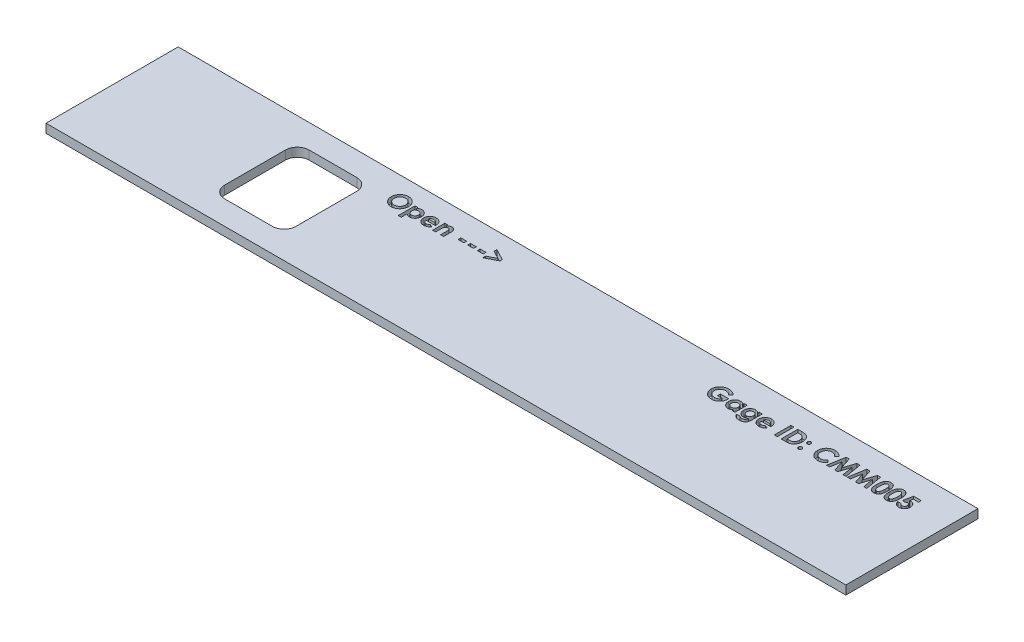
from build123d import *

# Parameters (mm, degrees)
SKETCH1_W           = 167.9
SKETCH1_H           = 27.75
BOSS_EXTRUDE1_DEPTH = 1.85
SKETCH2_W           = 15
SKETCH2_H           = 17.75
CUT_EXTRUDE1_DEPTH  = 171.187822714
FILLET1_R           = 2.5
SKETCH5_W           = 1.211538462
SKETCH5_H           = 0.583333333
SKETCH5_W_2         = 1.211538461
CUT_EXTRUDE3_DEPTH  = 1.25
SKETCH6_W           = 0.628205129
SKETCH6_H           = 3.5
CUT_EXTRUDE4_DEPTH  = 1.25


with BuildPart() as part:
    # Sketch1 → Boss-Extrude1 (new body)
    with BuildSketch(Plane(origin=(0, 0, 0), x_dir=(1, 0, 0), z_dir=(0, 1, 0))):
        with Locations((83.95, 13.875)):
            Rectangle(SKETCH1_W, SKETCH1_H)
    extrude(amount=BOSS_EXTRUDE1_DEPTH)

    # Sketch2 → Cut-Extrude1 (cut, through all)
    with BuildSketch(Plane(origin=(0, 1.85, 0), x_dir=(1, 0, 0), z_dir=(0, 1, 0))):
        with Locations((37.5, 13.875)):
            Rectangle(SKETCH2_W, SKETCH2_H)
    extrude(amount=-CUT_EXTRUDE1_DEPTH, mode=Mode.SUBTRACT)

    # Fillet1
    fillet1_edges = [part.edges().sort_by_distance(p)[0] for p in [
        (30, 0.925, -5),
        (30, 0.925, -22.75),
        (45, 0.925, -22.75),
        (45, 0.925, -5),
    ]]
    fillet(fillet1_edges, radius=FILLET1_R)

    # Sketch5 → Cut-Extrude3 (cut)
    # profile 1 of 8: a face of its own
    with BuildSketch(Plane(origin=(0, 1.85, 0), x_dir=(1, 0, 0), z_dir=(0, 1, 0))):
        with BuildLine():
            add(Edge.make_bspline(
                [(51.413346137, 24.717970988), (51.474197927, 24.716395426), (51.594333142, 24.71328491), (51.771008691, 24.687356333), (51.941268249, 24.645109433), (52.105034827, 24.586383187), (52.26189837, 24.50958699), (52.41241219, 24.416898063), (52.556037153, 24.306566959), (52.691301506, 24.181167521), (52.816310163, 24.044801107), (52.924630237, 23.897978419), (53.017001622, 23.74450378), (53.093559274, 23.583965949), (53.151872175, 23.415253126), (53.19279275, 23.239225524), (53.219082192, 23.05593322), (53.222105882, 22.931136144), (53.223642611, 22.867710571)],
                knots=[0, 0, 0, 0, 1.014329547, 2.002516266, 2.970391464, 3.935626869, 4.897733899, 5.877609409, 6.878433252, 7.912639331, 8.949961323, 9.958554974, 10.949718813, 11.932905612, 12.9188844, 13.919928257, 14.942845884, 16, 16, 16, 16], degree=3))
            add(Edge.make_bspline(
                [(53.223642611, 22.867710571), (53.222006061, 22.804999657), (53.218781187, 22.68142579), (53.193866, 22.499822597), (53.152256318, 22.325680617), (53.094932449, 22.158605676), (53.019763264, 21.999407027), (52.929193221, 21.84706821), (52.820832349, 21.703002964), (52.698632994, 21.567288601), (52.56410211, 21.444098696), (52.421612547, 21.335537805), (52.271822234, 21.243547402), (52.114950416, 21.168169625), (51.950660689, 21.109671708), (51.77935887, 21.068397176), (51.601055557, 21.04331381), (51.479800658, 21.040110001), (51.41825399, 21.038483808)],
                knots=[0, 0, 0, 0, 1.051557043, 2.072126891, 3.067553643, 4.050577992, 5.02905126, 6.015227836, 7.017913613, 8.04756643, 9.074058332, 10.072836633, 11.047628519, 12.017157415, 12.98668631, 13.966869689, 14.968021931, 16, 16, 16, 16], degree=3))
            add(Edge.make_bspline(
                [(51.41825399, 21.038483808), (51.353883554, 21.039942583), (51.227404448, 21.042808876), (51.042301709, 21.070066015), (50.864957291, 21.111124789), (50.696860989, 21.172402806), (50.536300886, 21.249005479), (50.384456664, 21.343346264), (50.241379353, 21.455269256), (50.107889667, 21.581908064), (49.986947689, 21.720478696), (49.88019267, 21.86686628), (49.790142443, 22.019952545), (49.716793714, 22.179809137), (49.658968523, 22.345442587), (49.61817942, 22.51786165), (49.594084324, 22.696652803), (49.590728017, 22.818091328), (49.589027227, 22.879629641)],
                knots=[0, 0, 0, 0, 1.067978421, 2.098431617, 3.099715153, 4.085208694, 5.062210972, 6.048429807, 7.046490867, 8.072918869, 9.098532598, 10.095778865, 11.076610158, 12.041847152, 13.011192615, 13.984257998, 14.978533688, 16, 16, 16, 16], degree=3))
            add(Edge.make_bspline(
                [(49.589027227, 22.879629641), (49.589561033, 22.921029397), (49.590621886, 23.003304692), (49.603400975, 23.12523248), (49.621799189, 23.244780401), (49.649009275, 23.361471816), (49.682062574, 23.476129928), (49.724887793, 23.587687472), (49.773634481, 23.697336189), (49.830590397, 23.803780991), (49.893919868, 23.906042495), (49.96301796, 24.003638317), (50.038058418, 24.095388381), (50.118799512, 24.18189563), (50.205519487, 24.262591446), (50.297077632, 24.338618191), (50.395249641, 24.407956323), (50.497886837, 24.472299218), (50.604410575, 24.530483382), (50.714387207, 24.580008003), (50.825550997, 24.623257011), (50.939386943, 24.65739104), (51.054675091, 24.685192849), (51.17264706, 24.703578663), (51.292237042, 24.716357398), (51.372880633, 24.717431848), (51.413346137, 24.717970988)],
                knots=[0, 0, 0, 0, 1.034744296, 2.056386356, 3.06226378, 4.057406941, 5.050368692, 6.043467995, 7.042652155, 8.049140477, 9.059438543, 10.048523776, 11.036952808, 12.020949711, 13.004946614, 13.997082645, 14.994316842, 16.007702937, 17.024872941, 18.026463647, 19.021641123, 20.005082605, 20.995858141, 21.984425357, 22.988620895, 24, 24, 24, 24], degree=3))
        make_face()
        with BuildLine():
            add(Edge.make_bspline(
                [(51.403530432, 24.089765859), (51.362577186, 24.088666992), (51.281751866, 24.086498267), (51.163195841, 24.069975517), (51.04937787, 24.043586808), (50.940928891, 24.005363084), (50.837378877, 23.956713986), (50.738544266, 23.897809498), (50.645793713, 23.826624845), (50.557890479, 23.746981613), (50.478484372, 23.65824075), (50.408326571, 23.563139823), (50.349615791, 23.461837649), (50.300445146, 23.355275302), (50.263430548, 23.242254516), (50.237066159, 23.123660595), (50.22040485, 22.999289196), (50.218304671, 22.914505375), (50.217232355, 22.87121618)],
                knots=[0, 0, 0, 0, 1.033739768, 2.040188636, 3.016340934, 3.979330865, 4.937572243, 5.900995986, 6.878200029, 7.884839167, 8.891893314, 9.879764717, 10.863503415, 11.843163062, 12.837761627, 13.859916423, 14.907309254, 16, 16, 16, 16], degree=3))
            add(Edge.make_bspline(
                [(50.217232355, 22.87121618), (50.218654082, 22.823242014), (50.221440432, 22.729220596), (50.24104553, 22.592064686), (50.2745879, 22.462534542), (50.32302243, 22.341263676), (50.383093954, 22.226905466), (50.457693254, 22.120861534), (50.545612172, 22.02249694), (50.613344195, 21.965067593), (50.647721137, 21.935919706)],
                knots=[0, 0, 0, 0, 1.078454662, 2.113592447, 3.107694534, 4.079536787, 5.043276885, 6.005368276, 6.987637804, 8, 8, 8, 8], degree=3))
            add(Edge.make_bspline(
                [(50.647721137, 21.935919706), (50.675882416, 21.914386366), (50.731570494, 21.871804837), (50.820460792, 21.817227872), (50.912000295, 21.770449969), (51.006879785, 21.732653976), (51.104898879, 21.702924284), (51.206044138, 21.682105069), (51.310172246, 21.669039211), (51.380588553, 21.667477594), (51.416150624, 21.666688936)],
                knots=[0, 0, 0, 0, 1.023928204, 2.024787132, 3.009472467, 3.9914905, 4.972207045, 5.96565515, 6.972602802, 8, 8, 8, 8], degree=3))
            add(Edge.make_bspline(
                [(51.416150624, 21.666688936), (51.456399678, 21.667797121), (51.535590958, 21.669977509), (51.651939999, 21.686296855), (51.763405914, 21.71391508), (51.870680692, 21.751803491), (51.973455002, 21.801063421), (52.071226558, 21.861794942), (52.164166779, 21.933252347), (52.251958025, 22.013941469), (52.332203375, 22.10303191), (52.402214771, 22.198640096), (52.462792259, 22.298659491), (52.510940401, 22.40450572), (52.549417362, 22.515179642), (52.575464441, 22.63117141), (52.592266501, 22.752002861), (52.594367272, 22.834232933), (52.595437483, 22.876124032)],
                knots=[0, 0, 0, 0, 1.026359118, 2.019393844, 2.989460624, 3.950973911, 4.916101784, 5.890408035, 6.881132271, 7.902007068, 8.92769091, 9.933912415, 10.920395702, 11.90457117, 12.894218921, 13.903490204, 14.931958862, 16, 16, 16, 16], degree=3))
            add(Edge.make_bspline(
                [(52.595437483, 22.876124032), (52.594330242, 22.917774246), (52.592150807, 22.99975634), (52.575802738, 23.120277134), (52.548359661, 23.235756832), (52.510357474, 23.346384025), (52.461830695, 23.452267169), (52.40182241, 23.553033915), (52.330543179, 23.648586847), (52.249633492, 23.738274808), (52.161568269, 23.820692299), (52.067021454, 23.8922157), (51.968638571, 23.954367261), (51.864162238, 24.003054284), (51.755729953, 24.041843132), (51.642680056, 24.070407797), (51.524584363, 24.086382194), (51.444241422, 24.088627917), (51.403530432, 24.089765859)],
                knots=[0, 0, 0, 0, 1.055025985, 2.07665775, 3.074803781, 4.057872707, 5.035505728, 6.020516407, 7.023567878, 8.050795229, 9.077271434, 10.074415901, 11.050397877, 12.019801805, 12.988065821, 13.964604439, 14.968634123, 16, 16, 16, 16], degree=3))
        make_face(mode=Mode.SUBTRACT)
    # profile 2 of 8: a face of its own
    with BuildSketch(Plane(origin=(0, 1.85, 0), x_dir=(1, 0, 0), z_dir=(0, 1, 0))):
        with BuildLine():
            Line((54.390309278, 23.685919706), (54.390309278, 23.397758648))
            add(Edge.make_bspline(
                [(54.390309278, 23.397758648), (54.419474082, 23.424554742), (54.476750747, 23.477179506), (54.570528143, 23.544554913), (54.666898573, 23.602419933), (54.767632741, 23.648961957), (54.871348207, 23.685633387), (54.97897432, 23.711400405), (55.089719809, 23.728394444), (55.164985763, 23.729988378), (55.202909438, 23.7307915)],
                knots=[0, 0, 0, 0, 1.054376801, 2.070687235, 3.070225973, 4.045259405, 5.022040922, 5.996139433, 6.99033025, 8, 8, 8, 8], degree=3))
            add(Edge.make_bspline(
                [(55.202909438, 23.7307915), (55.244106445, 23.729804728), (55.325251182, 23.727861107), (55.444640222, 23.709714613), (55.55905306, 23.680382054), (55.668925982, 23.639425806), (55.773673596, 23.586250959), (55.874472818, 23.522584119), (55.969585245, 23.445798045), (56.059057116, 23.35882494), (56.141820825, 23.263495956), (56.21381001, 23.159853119), (56.273774208, 23.049260566), (56.324596811, 22.933025733), (56.361689189, 22.809220904), (56.390276898, 22.679506837), (56.406207574, 22.542786124), (56.408414824, 22.449646751), (56.409540047, 22.402165699)],
                knots=[0, 0, 0, 0, 0.985987466, 1.942075377, 2.884088208, 3.810275091, 4.743821533, 5.692411115, 6.659945104, 7.665215984, 8.677116751, 9.678438675, 10.680260931, 11.685531812, 12.710472044, 13.769734641, 14.863044265, 16, 16, 16, 16], degree=3))
            add(Edge.make_bspline(
                [(56.409540047, 22.402165699), (56.408475099, 22.35631005), (56.406375851, 22.265918456), (56.389415249, 22.133216158), (56.36066845, 22.006447844), (56.320342516, 21.88556786), (56.269077389, 21.770194205), (56.206504764, 21.660406378), (56.13225964, 21.556587864), (56.047378305, 21.460137204), (55.95463311, 21.372793962), (55.857999266, 21.294429708), (55.755552142, 21.230216347), (55.64985269, 21.175983244), (55.53923574, 21.13451224), (55.424456856, 21.105457141), (55.30569782, 21.086032004), (55.22495614, 21.084256622), (55.18397915, 21.083355603)],
                knots=[0, 0, 0, 0, 1.098553145, 2.165490463, 3.199345634, 4.208780719, 5.21409072, 6.219899742, 7.23156933, 8.267303578, 9.293302409, 10.281606823, 11.243293419, 12.184993323, 13.124258899, 14.066907486, 15.018941492, 16, 16, 16, 16], degree=3))
            add(Edge.make_bspline(
                [(55.18397915, 21.083355603), (55.14746391, 21.08424117), (55.075531084, 21.085985683), (54.969755538, 21.101540237), (54.867575159, 21.124773452), (54.768854784, 21.159742031), (54.672484618, 21.206145042), (54.576823359, 21.263931602), (54.481649801, 21.334527721), (54.421409363, 21.388978498), (54.390309278, 21.417089577)],
                knots=[0, 0, 0, 0, 0.990856396, 1.951927477, 2.896945079, 3.83213376, 4.788585491, 5.796263726, 6.862286081, 8, 8, 8, 8], degree=3))
            Line((54.390309278, 21.417089577), (54.390309278, 20.185919706))
            Line((54.390309278, 20.185919706), (53.76210415, 20.185919706))
            Line((53.76210415, 20.185919706), (53.76210415, 23.685919706))
            Line((53.76210415, 23.685919706), (54.390309278, 23.685919706))
        make_face()
        with BuildLine():
            add(Edge.make_bspline(
                [(55.06689181, 23.147458167), (55.041397372, 23.146674196), (54.991414414, 23.145137185), (54.918030327, 23.136328586), (54.848497614, 23.119755142), (54.781759084, 23.098274261), (54.71865984, 23.069278446), (54.658683658, 23.034129558), (54.60234424, 22.992217192), (54.549349186, 22.945201026), (54.501728917, 22.892307751), (54.459422439, 22.835788543), (54.424323579, 22.774907415), (54.395064854, 22.710436334), (54.372990425, 22.641677729), (54.356617594, 22.56921653), (54.347719998, 22.492830676), (54.346210355, 22.440748556), (54.345437483, 22.41408477)],
                knots=[0, 0, 0, 0, 1.060469436, 2.079096586, 3.066888298, 4.028858836, 4.99004353, 5.948472697, 6.914558426, 7.905691313, 8.889602648, 9.869280844, 10.836099585, 11.806137001, 12.808075328, 13.83377171, 14.890985086, 16, 16, 16, 16], degree=3))
            add(Edge.make_bspline(
                [(54.345437483, 22.41408477), (54.34622008, 22.386954345), (54.34775596, 22.33370972), (54.356579383, 22.25569504), (54.372837293, 22.181782108), (54.395376652, 22.111803345), (54.4241375, 22.045749673), (54.459194774, 21.983376219), (54.501966937, 21.92605049), (54.54906408, 21.871762647), (54.602386816, 21.824117395), (54.658472423, 21.781386158), (54.718645269, 21.746184876), (54.782046066, 21.717663517), (54.848193736, 21.693962424), (54.918074005, 21.67794762), (54.991402824, 21.668975661), (55.041393457, 21.667461337), (55.06689181, 21.666688936)],
                knots=[0, 0, 0, 0, 1.117193555, 2.192540452, 3.22680955, 4.227918444, 5.21468246, 6.188555072, 7.166222992, 8.154674427, 9.142376254, 10.104580718, 11.053462639, 12.005072638, 12.963662044, 13.941614018, 14.950094269, 16, 16, 16, 16], degree=3))
            add(Edge.make_bspline(
                [(55.06689181, 21.666688936), (55.091462668, 21.667406473), (55.140098873, 21.668826783), (55.211261881, 21.678737209), (55.27966726, 21.69493183), (55.344779307, 21.718015024), (55.406994384, 21.748069318), (55.466878878, 21.783237817), (55.522365354, 21.827178231), (55.575630636, 21.875472497), (55.623288833, 21.929934539), (55.666043964, 21.987793286), (55.701959544, 22.049565139), (55.730475668, 22.115454942), (55.754050761, 22.184214646), (55.770146221, 22.257102792), (55.779001648, 22.333468802), (55.780549435, 22.385550531), (55.781334919, 22.411981404)],
                knots=[0, 0, 0, 0, 1.021711385, 2.02240246, 2.981887075, 3.941027022, 4.888772411, 5.852236371, 6.822344989, 7.82661704, 8.838806642, 9.826383926, 10.814965113, 11.80282933, 12.807900643, 13.833672313, 14.900613836, 16, 16, 16, 16], degree=3))
            add(Edge.make_bspline(
                [(55.781334919, 22.411981404), (55.780536891, 22.438174489), (55.778964553, 22.489782198), (55.770290466, 22.565512283), (55.753575307, 22.637340762), (55.732470291, 22.705854419), (55.702984691, 22.770161386), (55.668120942, 22.831022404), (55.627097283, 22.888621239), (55.57950807, 22.941403004), (55.527311092, 22.989430618), (55.471591706, 23.031911439), (55.412568729, 23.068074721), (55.349438396, 23.096593565), (55.283690483, 23.120058427), (55.214320226, 23.136221335), (55.141680296, 23.145166792), (55.09215613, 23.146684117), (55.06689181, 23.147458167)],
                knots=[0, 0, 0, 0, 1.094680664, 2.156827393, 3.177782763, 4.17210342, 5.146667393, 6.126451192, 7.099203661, 8.094961544, 9.09004898, 10.058676268, 11.018205477, 11.974998356, 12.947750825, 13.930643515, 14.944335875, 16, 16, 16, 16], degree=3))
        make_face(mode=Mode.SUBTRACT)
    # profile 3 of 8: a face of its own
    with BuildSketch(Plane(origin=(0, 1.85, 0), x_dir=(1, 0, 0), z_dir=(0, 1, 0))):
        with BuildLine():
            Line((59.503590528, 22.25002227), (57.486463124, 22.25002227))
            add(Edge.make_bspline(
                [(57.486463124, 22.25002227), (57.490575884, 22.226584394), (57.498657782, 22.180527118), (57.51620791, 22.113624929), (57.538604505, 22.050577435), (57.565445415, 21.991300357), (57.596278101, 21.935480321), (57.632241874, 21.883379144), (57.672880568, 21.835042846), (57.717959219, 21.790681501), (57.766726449, 21.750932775), (57.818945755, 21.716110378), (57.874671023, 21.687558143), (57.933263385, 21.663491571), (57.99516066, 21.644428408), (58.060453946, 21.631280907), (58.128970159, 21.62351463), (58.175645497, 21.622391327), (58.19950399, 21.621817141)],
                knots=[0, 0, 0, 0, 1.091296461, 2.144483647, 3.168565212, 4.157007626, 5.126487748, 6.090021542, 7.05641414, 8.019231907, 8.98705074, 9.938580405, 10.892824166, 11.854447369, 12.841318655, 13.858982407, 14.905600794, 16, 16, 16, 16], degree=3))
            add(Edge.make_bspline(
                [(58.19950399, 21.621817141), (58.22830281, 21.622577458), (58.285016168, 21.624074746), (58.36810166, 21.637353461), (58.448457434, 21.657410378), (58.52532304, 21.687236696), (58.599588847, 21.72436522), (58.670032211, 21.770622791), (58.737872451, 21.824657614), (58.779262992, 21.866307634), (58.800365368, 21.887542302)],
                knots=[0, 0, 0, 0, 1.021034703, 2.010718019, 2.977989445, 3.954245119, 4.929443971, 5.918328161, 6.938689359, 8, 8, 8, 8], degree=3))
            Line((58.800365368, 21.887542302), (59.326206714, 21.637241821))
            add(Edge.make_bspline(
                [(59.326206714, 21.637241821), (59.309650906, 21.614364235), (59.276846182, 21.569033141), (59.22329357, 21.505240583), (59.167408009, 21.445719539), (59.109147821, 21.390861487), (59.048439116, 21.340822752), (58.985450771, 21.29499377), (58.919262238, 21.254605032), (58.851196945, 21.217702555), (58.779847855, 21.186066233), (58.705412423, 21.159087894), (58.628205925, 21.134699705), (58.547253411, 21.116117241), (58.463228969, 21.101407514), (58.375931599, 21.090961659), (58.285372804, 21.084509755), (58.223820519, 21.08374489), (58.192492772, 21.083355603)],
                knots=[0, 0, 0, 0, 1.028154879, 2.037251081, 3.030720504, 4.000128189, 4.949298328, 5.894184978, 6.834267904, 7.770992897, 8.712077017, 9.673380525, 10.653304757, 11.658697181, 12.695551717, 13.758623199, 14.859225354, 16, 16, 16, 16], degree=3))
            add(Edge.make_bspline(
                [(58.192492772, 21.083355603), (58.144295547, 21.084338199), (58.04990406, 21.086262558), (57.911839446, 21.104123358), (57.780716357, 21.133738491), (57.656164547, 21.173995714), (57.53872241, 21.227147862), (57.428331826, 21.292157347), (57.323889834, 21.367777808), (57.22858772, 21.455596318), (57.141764682, 21.551181544), (57.065504724, 21.653833551), (57.001691477, 21.762835146), (56.949286756, 21.877464934), (56.908555985, 21.998016324), (56.879191463, 22.12454192), (56.861190658, 22.256981292), (56.859246482, 22.347187289), (56.858257996, 22.393051116)],
                knots=[0, 0, 0, 0, 1.103565453, 2.161269334, 3.182010356, 4.179077853, 5.15417608, 6.128274628, 7.109042802, 8.101804412, 9.090965879, 10.063106201, 11.02526161, 11.978650795, 12.945248442, 13.93468508, 14.949922959, 16, 16, 16, 16], degree=3))
            add(Edge.make_bspline(
                [(56.858257996, 22.393051116), (56.859256211, 22.440080401), (56.861220153, 22.532608409), (56.879036476, 22.668105867), (56.908637168, 22.797388768), (56.949487085, 22.92063515), (57.001096821, 23.038230474), (57.065721981, 23.149145921), (57.141726839, 23.253767639), (57.228237098, 23.351606197), (57.323942941, 23.439916184), (57.425639442, 23.518618031), (57.534469264, 23.584197634), (57.649201449, 23.637185913), (57.769102128, 23.680237551), (57.895557186, 23.708884821), (58.027604492, 23.728119748), (58.117869122, 23.729891165), (58.163746778, 23.7307915)],
                knots=[0, 0, 0, 0, 1.079208495, 2.12329425, 3.130605359, 4.119693003, 5.099659317, 6.073216462, 7.060498243, 8.06384408, 9.066070512, 10.045757761, 11.010926815, 11.975797609, 12.942977511, 13.929384301, 14.947594487, 16, 16, 16, 16], degree=3))
            add(Edge.make_bspline(
                [(58.163746778, 23.7307915), (58.2121749, 23.72979366), (58.307258528, 23.727834502), (58.446284718, 23.710118728), (58.578278449, 23.680323006), (58.703802086, 23.640413879), (58.821252642, 23.585919052), (58.933210862, 23.522509347), (59.036991352, 23.445254293), (59.133700301, 23.357865539), (59.220999893, 23.260910745), (59.29730941, 23.155588143), (59.362239416, 23.042925621), (59.414865831, 22.922466308), (59.455554778, 22.794571834), (59.484946483, 22.659408295), (59.502809984, 22.516461595), (59.504717983, 22.418577797), (59.505693893, 22.368511853)],
                knots=[0, 0, 0, 0, 1.080001299, 2.120471247, 3.119684163, 4.095710327, 5.052285597, 6.002875087, 6.961153713, 7.931888285, 8.906493152, 9.865905668, 10.82813294, 11.801621613, 12.7925306, 13.817193356, 14.883530496, 16, 16, 16, 16], degree=3))
            Line((59.505693893, 22.368511853), (59.503590528, 22.25002227))
        make_face()
        with BuildLine():
            add(Edge.make_bspline(
                [(58.877488765, 22.743612013), (58.86563415, 22.775602817), (58.842064088, 22.839208869), (58.788820297, 22.9269697), (58.71816749, 23.002974144), (58.635993207, 23.070261481), (58.542103943, 23.124876086), (58.439458314, 23.164418835), (58.32935374, 23.188129163), (58.253607727, 23.190909968), (58.214928669, 23.192329962)],
                knots=[0, 0, 0, 0, 0.954238005, 1.897273737, 2.851915805, 3.847685534, 4.862635127, 5.880135777, 6.917509367, 8, 8, 8, 8], degree=3))
            add(Edge.make_bspline(
                [(58.214928669, 23.192329962), (58.172684841, 23.190965884), (58.090106952, 23.188299397), (57.970993971, 23.159940324), (57.858637675, 23.117615255), (57.792398772, 23.073977209), (57.759199502, 23.052105603)],
                knots=[0, 0, 0, 0, 1.044195649, 2.041185066, 3.018232172, 4, 4, 4, 4], degree=3))
            add(Edge.make_bspline(
                [(57.759199502, 23.052105603), (57.738485638, 23.035447709), (57.694324738, 22.999933929), (57.636972849, 22.929087311), (57.580480762, 22.843307961), (57.548361896, 22.778152484), (57.531334919, 22.743612013)],
                knots=[0, 0, 0, 0, 0.82159062, 1.751589201, 2.808063854, 4, 4, 4, 4], degree=3))
            Line((57.531334919, 22.743612013), (58.877488765, 22.743612013))
        make_face(mode=Mode.SUBTRACT)
    # profile 4 of 8: a face of its own
    with BuildSketch(Plane(origin=(0, 1.85, 0), x_dir=(1, 0, 0), z_dir=(0, 1, 0))):
        with BuildLine():
            Line((60.044155432, 23.685919706), (60.67236056, 23.685919706))
            Line((60.67236056, 23.685919706), (60.67236056, 23.415286693))
            add(Edge.make_bspline(
                [(60.67236056, 23.415286693), (60.708199351, 23.443162843), (60.776694248, 23.496439584), (60.880818317, 23.564367701), (60.979098547, 23.619964137), (61.073725709, 23.662253631), (61.166480216, 23.692679104), (61.258864293, 23.714537991), (61.352253726, 23.728534837), (61.415034095, 23.730039683), (61.446399022, 23.7307915)],
                knots=[0, 0, 0, 0, 1.276643801, 2.439914479, 3.493451431, 4.44993799, 5.350072675, 6.235028322, 7.118224225, 8, 8, 8, 8], degree=3))
            add(Edge.make_bspline(
                [(61.446399022, 23.7307915), (61.478214519, 23.729932329), (61.540671013, 23.728245702), (61.632634759, 23.716449117), (61.720497188, 23.694963798), (61.805246238, 23.666437105), (61.886019312, 23.628783507), (61.963805927, 23.584075968), (62.036935256, 23.529619161), (62.081971534, 23.488147471), (62.104752387, 23.467169706)],
                knots=[0, 0, 0, 0, 1.048836932, 2.058954983, 3.049370783, 4.026390553, 5.001981509, 5.982488534, 6.97947532, 8, 8, 8, 8], degree=3))
            add(Edge.make_bspline(
                [(62.104752387, 23.467169706), (62.12302347, 23.447729451), (62.159699359, 23.408706663), (62.205851357, 23.341928677), (62.245454962, 23.26912845), (62.277904614, 23.189466206), (62.301883599, 23.102504255), (62.32033096, 23.009292972), (62.330682096, 22.909310442), (62.331959992, 22.840623388), (62.33261697, 22.805310731)],
                knots=[0, 0, 0, 0, 0.889584746, 1.785680191, 2.700364693, 3.65222533, 4.649950538, 5.707241244, 6.821271309, 8, 8, 8, 8], degree=3))
            Line((62.33261697, 22.805310731), (62.33261697, 21.128227398))
            Line((62.33261697, 21.128227398), (61.704411842, 21.128227398))
            Line((61.704411842, 21.128227398), (61.704411842, 22.238804321))
            add(Edge.make_bspline(
                [(61.704411842, 22.238804321), (61.704278991, 22.275029405), (61.704024405, 22.344448056), (61.702069754, 22.443796578), (61.698253135, 22.533521195), (61.694774387, 22.61378527), (61.687944221, 22.684303811), (61.681784667, 22.745523254), (61.672333429, 22.796888213), (61.660035835, 22.852138933), (61.638561206, 22.911294932), (61.605222892, 22.973625551), (61.562928566, 23.0265768), (61.513405697, 23.070519896), (61.456708978, 23.105282916), (61.393523508, 23.129740865), (61.324188035, 23.14498366), (61.275875893, 23.146612345), (61.250786041, 23.147458167)],
                knots=[0, 0, 0, 0, 1.49886392, 2.872294502, 4.110984203, 5.214877267, 6.195405875, 7.042225351, 7.75923308, 8.355011229, 9.382752534, 10.352059385, 11.267231453, 12.171456522, 13.078624015, 14.003401117, 14.963110155, 16, 16, 16, 16], degree=3))
            add(Edge.make_bspline(
                [(61.250786041, 23.147458167), (61.218155633, 23.14580347), (61.154324213, 23.142566562), (61.062004833, 23.118157319), (60.97721102, 23.076644383), (60.900635611, 23.019198826), (60.833007921, 22.948275169), (60.777307961, 22.863690571), (60.731622551, 22.767486477), (60.711977146, 22.697241862), (60.701807675, 22.660879641)],
                knots=[0, 0, 0, 0, 0.984188326, 1.925263693, 2.85911992, 3.81709677, 4.80007086, 5.801799564, 6.862098548, 8, 8, 8, 8], degree=3))
            add(Edge.make_bspline(
                [(60.701807675, 22.660879641), (60.699280158, 22.649459842), (60.693643286, 22.623991395), (60.689007672, 22.580965236), (60.682559196, 22.529918864), (60.68014311, 22.469928484), (60.675941803, 22.401278005), (60.674387959, 22.323876604), (60.672831335, 22.237876052), (60.672522684, 22.177807934), (60.67236056, 22.146256244)],
                knots=[0, 0, 0, 0, 0.543362196, 1.211806945, 2.009705693, 2.934833164, 4.000995085, 5.207458376, 6.533175157, 8, 8, 8, 8], degree=3))
            Line((60.67236056, 22.146256244), (60.67236056, 21.128227398))
            Line((60.67236056, 21.128227398), (60.044155432, 21.128227398))
            Line((60.044155432, 21.128227398), (60.044155432, 23.685919706))
        make_face()
    # profile 5 of 8: a face of its own
    with BuildSketch(Plane(origin=(0, 1.85, 0), x_dir=(1, 0, 0), z_dir=(0, 1, 0))):
        with Locations((65.002488765, 22.407073552)):
            Rectangle(SKETCH5_W, SKETCH5_H)
    # profile 6 of 8: a face of its own
    with BuildSketch(Plane(origin=(0, 1.85, 0), x_dir=(1, 0, 0), z_dir=(0, 1, 0))):
        with Locations((67.021719535, 22.407073552)):
            Rectangle(SKETCH5_W_2, SKETCH5_H)
    # profile 7 of 8: a face of its own
    with BuildSketch(Plane(origin=(0, 1.85, 0), x_dir=(1, 0, 0), z_dir=(0, 1, 0))):
        with Locations((69.040950304, 22.407073552)):
            Rectangle(SKETCH5_W_2, SKETCH5_H)
    # profile 8 of 8: a face of its own
    with BuildSketch(Plane(origin=(0, 1.85, 0), x_dir=(1, 0, 0), z_dir=(0, 1, 0))):
        Polygon((70.319796458, 23.7307915), (70.319796458, 24.330951757), (72.698001586, 23.104689738), (72.698001586, 22.606893263), (70.319796458, 21.381332366), (70.319796458, 21.9807915), (72.017212323, 22.8557915), align=None)
    extrude(amount=-CUT_EXTRUDE3_DEPTH, mode=Mode.SUBTRACT)

    # Sketch6 → Cut-Extrude4 (cut)
    # profile 1 of 14: a face of its own
    with BuildSketch(Plane(origin=(0, 1.85, 0), x_dir=(1, 0, 0), z_dir=(0, 1, 0))):
        with BuildLine():
            Line((121.523141212, 22.701549308), (121.047780635, 22.246521263))
            add(Edge.make_bspline(
                [(121.047780635, 22.246521263), (121.010145509, 22.284201483), (120.936299178, 22.358136295), (120.815532741, 22.454367534), (120.690455364, 22.536183111), (120.560655367, 22.603457602), (120.425951937, 22.655641546), (120.286610903, 22.692970391), (120.142405575, 22.715110761), (120.044785005, 22.718210337), (119.995396821, 22.719778475)],
                knots=[0, 0, 0, 0, 1.075575784, 2.110457258, 3.113929901, 4.09197124, 5.059417775, 6.02750972, 7.002078037, 8, 8, 8, 8], degree=3))
            add(Edge.make_bspline(
                [(119.995396821, 22.719778475), (119.952578776, 22.718679688), (119.868501792, 22.716522124), (119.744958761, 22.700137731), (119.626905827, 22.67276834), (119.513785259, 22.634852619), (119.406287698, 22.585512282), (119.303790283, 22.525508839), (119.206923783, 22.45438326), (119.116450953, 22.373483838), (119.03407515, 22.285158002), (118.962156724, 22.190618125), (118.900897676, 22.091626351), (118.850468986, 21.987676222), (118.812098237, 21.878927281), (118.784706543, 21.765458475), (118.767319629, 21.647599559), (118.765266754, 21.567194987), (118.764226949, 21.52646918)],
                knots=[0, 0, 0, 0, 1.075001177, 2.110859044, 3.123021556, 4.114053297, 5.101481495, 6.087880186, 7.091499647, 8.114004866, 9.131394192, 10.11971144, 11.092043119, 12.050101265, 13.015322563, 13.981809771, 14.977764287, 16, 16, 16, 16], degree=3))
            add(Edge.make_bspline(
                [(118.764226949, 21.52646918), (118.765196829, 21.484333798), (118.767107624, 21.401321327), (118.785462973, 21.279496958), (118.813742549, 21.162293137), (118.855136307, 21.050579488), (118.906079487, 20.94282569), (118.970683833, 20.841119038), (119.046018965, 20.743906358), (119.13195027, 20.65288018), (119.225421339, 20.568975951), (119.326653547, 20.496598003), (119.432566791, 20.434151457), (119.544870516, 20.384695811), (119.66161546, 20.344988346), (119.783985752, 20.316991175), (119.911705846, 20.299815008), (119.998848114, 20.297749701), (120.043073103, 20.296701551)],
                knots=[0, 0, 0, 0, 1.022067601, 2.013613092, 2.983553406, 3.943623673, 4.90013463, 5.87121881, 6.861774014, 7.881098904, 8.905697761, 9.905387765, 10.89678721, 11.884561068, 12.87834324, 13.885584958, 14.926927371, 16, 16, 16, 16], degree=3))
            add(Edge.make_bspline(
                [(120.043073103, 20.296701551), (120.071839821, 20.296961109), (120.128315289, 20.297470677), (120.211155177, 20.305742405), (120.290495891, 20.317567801), (120.366644698, 20.333223222), (120.438832699, 20.355378452), (120.508059385, 20.381286264), (120.573919149, 20.411862649), (120.636054907, 20.448162549), (120.695391419, 20.488850298), (120.751373284, 20.535405737), (120.804982489, 20.586779209), (120.855592618, 20.643598316), (120.90234708, 20.706371087), (120.946743768, 20.773943989), (120.988274349, 20.846987641), (121.012813673, 20.898567368), (121.025344738, 20.92490668)],
                knots=[0, 0, 0, 0, 1.109579412, 2.178351274, 3.208885622, 4.204702371, 5.174744997, 6.119429583, 7.05542196, 7.97267548, 8.893247984, 9.828544973, 10.778894627, 11.756245826, 12.760884819, 13.796418446, 14.874735809, 16, 16, 16, 16], degree=3))
            Line((121.025344738, 20.92490668), (120.020637206, 20.92490668))
            Line((120.020637206, 20.92490668), (120.020637206, 21.553111808))
            Line((120.020637206, 21.553111808), (121.765729353, 21.553111808))
            Line((121.765729353, 21.553111808), (121.770637206, 21.403772866))
            add(Edge.make_bspline(
                [(121.770637206, 21.403772866), (121.770006583, 21.365418836), (121.768746464, 21.288779223), (121.757230292, 21.174675895), (121.738153928, 21.062085912), (121.712074713, 20.951122355), (121.679390859, 20.841240908), (121.637708715, 20.733493779), (121.588899178, 20.627150261), (121.534211556, 20.522662232), (121.472758403, 20.422403128), (121.40659506, 20.327470991), (121.336664731, 20.238030129), (121.261446461, 20.155326676), (121.182111521, 20.078665888), (121.098503739, 20.008342687), (121.0103274, 19.944297572), (120.918049609, 19.885989508), (120.821144754, 19.83488593), (120.720145618, 19.790432596), (120.615204697, 19.752679319), (120.506051057, 19.721729844), (120.392899486, 19.697849862), (120.275747559, 19.681475327), (120.154530936, 19.670348646), (120.072312264, 19.669121295), (120.030452911, 19.668496423)],
                knots=[0, 0, 0, 0, 1.006889344, 2.011981806, 3.007738725, 4.003571281, 5.003404394, 6.015442001, 7.03424805, 8.074616296, 9.110249922, 10.119753985, 11.111721717, 12.089233633, 13.052717867, 14.006597561, 14.955430184, 15.912305663, 16.870361111, 17.829300583, 18.807640451, 19.796414044, 20.806216501, 21.841577364, 22.90109906, 24, 24, 24, 24], degree=3))
            add(Edge.make_bspline(
                [(120.030452911, 19.668496423), (119.985791819, 19.669113496), (119.897260214, 19.670336717), (119.766354372, 19.681793021), (119.639246189, 19.700700911), (119.515903962, 19.726868785), (119.396041315, 19.759436794), (119.279864192, 19.800317349), (119.167610205, 19.848946062), (119.058943207, 19.904035226), (118.955252079, 19.966511136), (118.856769212, 20.035278271), (118.764032142, 20.110778977), (118.676090954, 20.191749357), (118.595000296, 20.28017967), (118.517738234, 20.37320346), (118.448047851, 20.47423247), (118.382932668, 20.579991309), (118.32508382, 20.690435658), (118.27449417, 20.803522793), (118.231351345, 20.918597938), (118.197332185, 21.036196922), (118.169711813, 21.155499746), (118.149948918, 21.27702523), (118.138787888, 21.400758163), (118.136947937, 21.483913103), (118.136021821, 21.525768058)],
                knots=[0, 0, 0, 0, 1.084149091, 2.14910686, 3.187506334, 4.202448172, 5.208724393, 6.201130722, 7.189831603, 8.176984443, 9.156919086, 10.126598231, 11.090766514, 12.05840148, 13.026036446, 14.001772938, 14.991905635, 16.003017641, 17.015720547, 18.016462227, 19.009322657, 19.99686681, 20.986544154, 21.980959929, 22.983742515, 24, 24, 24, 24], degree=3))
            add(Edge.make_bspline(
                [(118.136021821, 21.525768058), (118.137262088, 21.58286716), (118.139711246, 21.695620958), (118.162394171, 21.861708018), (118.197753472, 22.022380676), (118.248497629, 22.177053774), (118.313614365, 22.325940376), (118.392181243, 22.469389999), (118.485904906, 22.60725017), (118.558453458, 22.692604763), (118.595256597, 22.735904276)],
                knots=[0, 0, 0, 0, 1.034044851, 2.041932006, 3.031217818, 4.011390712, 4.986069675, 5.97149666, 6.970960976, 8, 8, 8, 8], degree=3))
            add(Edge.make_bspline(
                [(118.595256597, 22.735904276), (118.618107307, 22.760954356), (118.663465622, 22.81067839), (118.735970806, 22.879770946), (118.810314741, 22.944720505), (118.887527104, 23.004149852), (118.967202003, 23.059359924), (119.049568756, 23.109315764), (119.134195287, 23.155607993), (119.22174158, 23.195872754), (119.311749318, 23.231973471), (119.404617131, 23.262519753), (119.499649458, 23.289576499), (119.597687814, 23.310159744), (119.697741777, 23.327299899), (119.800521564, 23.338788128), (119.905747094, 23.347208182), (119.97691635, 23.347723085), (120.012924866, 23.347983603)],
                knots=[0, 0, 0, 0, 1.020590567, 2.025856924, 3.013483481, 3.991664875, 4.957826714, 5.930500614, 6.890802512, 7.860442893, 8.829981142, 9.809047939, 10.802672283, 11.803273349, 12.823572789, 13.857849586, 14.916166035, 16, 16, 16, 16], degree=3))
            add(Edge.make_bspline(
                [(120.012924866, 23.347983603), (120.050565456, 23.34740312), (120.125456408, 23.346248173), (120.236806852, 23.338256691), (120.346610007, 23.325927719), (120.454403152, 23.307433556), (120.560548041, 23.284626404), (120.664495242, 23.255404797), (120.766922883, 23.222203789), (120.833602889, 23.195733492), (120.866891212, 23.182518859)],
                knots=[0, 0, 0, 0, 1.03180557, 2.052914215, 3.058998889, 4.059601663, 5.049854447, 6.033765722, 7.018406786, 8, 8, 8, 8], degree=3))
            add(Edge.make_bspline(
                [(120.866891212, 23.182518859), (120.894899218, 23.17030616), (120.951866728, 23.145465867), (121.034747433, 23.100019387), (121.117830638, 23.049636748), (121.200219833, 22.992475843), (121.281789481, 22.928643591), (121.363391254, 22.85914821), (121.444192134, 22.783179346), (121.496484037, 22.729111709), (121.523141212, 22.701549308)],
                knots=[0, 0, 0, 0, 0.894392155, 1.819168899, 2.76525314, 3.739198753, 4.75366411, 5.797420238, 6.877176959, 8, 8, 8, 8], degree=3))
        make_face()
    # profile 2 of 14: a face of its own
    with BuildSketch(Plane(origin=(0, 1.85, 0), x_dir=(1, 0, 0), z_dir=(0, 1, 0))):
        with BuildLine():
            Line((124.238585924, 22.315932321), (124.866791052, 22.315932321))
            Line((124.866791052, 22.315932321), (124.866791052, 19.758240013))
            Line((124.866791052, 19.758240013), (124.238585924, 19.758240013))
            Line((124.238585924, 19.758240013), (124.238585924, 20.037286487))
            add(Edge.make_bspline(
                [(124.238585924, 20.037286487), (124.207458591, 20.010124401), (124.147046586, 19.957408157), (124.051856813, 19.889007489), (123.956388885, 19.832585778), (123.860184075, 19.787648962), (123.761763756, 19.754467749), (123.660419341, 19.730443776), (123.554691363, 19.716276251), (123.48281894, 19.71434766), (123.446318296, 19.713368218)],
                knots=[0, 0, 0, 0, 1.129196829, 2.191548051, 3.199897424, 4.157751732, 5.089409408, 6.034969131, 7.002052659, 8, 8, 8, 8], degree=3))
            add(Edge.make_bspline(
                [(123.446318296, 19.713368218), (123.405344699, 19.714289996), (123.324378551, 19.716111481), (123.205569718, 19.73528555), (123.090847977, 19.764635737), (122.980306452, 19.806169921), (122.874146262, 19.859990079), (122.771554961, 19.924691971), (122.674291275, 20.002547018), (122.581545518, 20.090186631), (122.496628059, 20.18659083), (122.422392415, 20.290421536), (122.359817285, 20.400206141), (122.308552828, 20.515580658), (122.268226713, 20.636460409), (122.239479964, 20.763228787), (122.222519348, 20.895931068), (122.220420102, 20.986322664), (122.219355155, 21.032178314)],
                knots=[0, 0, 0, 0, 0.980476535, 1.937477201, 2.874147792, 3.812856188, 4.758993464, 5.720109578, 6.712210464, 7.737600662, 8.772720504, 9.783789959, 10.789002326, 11.793715968, 12.802552247, 13.835794126, 14.902098527, 16, 16, 16, 16], degree=3))
            add(Edge.make_bspline(
                [(122.219355155, 21.032178314), (122.220472821, 21.0796619), (122.222665248, 21.172806245), (122.238702721, 21.309491141), (122.266918985, 21.439402731), (122.305393889, 21.562720959), (122.354885172, 21.679467132), (122.415162249, 21.789832515), (122.487045131, 21.893528633), (122.56987741, 21.988790503), (122.659315926, 22.076102608), (122.754999327, 22.15211472), (122.855431334, 22.216690546), (122.960718673, 22.26940948), (123.070846309, 22.310148004), (123.18537946, 22.339931192), (123.304826571, 22.35780215), (123.386194911, 22.35979515), (123.427388007, 22.360804116)],
                knots=[0, 0, 0, 0, 1.136281865, 2.228943489, 3.287578264, 4.313574083, 5.316051562, 6.317280042, 7.318008486, 8.329309503, 9.333984563, 10.305318864, 11.248632312, 12.186624717, 13.117503092, 14.05354244, 15.014596925, 16, 16, 16, 16], degree=3))
            add(Edge.make_bspline(
                [(123.427388007, 22.360804116), (123.465546161, 22.360011372), (123.541047394, 22.358442818), (123.652023328, 22.341411324), (123.759653978, 22.3156524), (123.863352213, 22.278950568), (123.963968601, 22.23260704), (124.059772477, 22.174535144), (124.152859636, 22.107175618), (124.209657439, 22.0545664), (124.238585924, 22.027771263)],
                knots=[0, 0, 0, 0, 1.017011718, 2.012299608, 2.98747302, 3.965332399, 4.941441765, 5.936729654, 6.94912688, 8, 8, 8, 8], degree=3))
            Line((124.238585924, 22.027771263), (124.238585924, 22.315932321))
        make_face()
        with BuildLine():
            add(Edge.make_bspline(
                [(123.559198905, 21.777470782), (123.534166782, 21.77670271), (123.485105456, 21.775197339), (123.412954063, 21.766142429), (123.343998975, 21.750187273), (123.278731975, 21.726616957), (123.216180346, 21.697904877), (123.157293943, 21.66194347), (123.101586758, 21.619437851), (123.049386413, 21.57141708), (123.001798107, 21.518633473), (122.960774209, 21.461035122), (122.925910524, 21.400173974), (122.896424908, 21.335867042), (122.875319896, 21.267353375), (122.858604735, 21.195524899), (122.849930649, 21.119794813), (122.848358311, 21.068187104), (122.847560283, 21.041994019)],
                knots=[0, 0, 0, 0, 1.04836806, 2.054732945, 3.03993516, 4.00574415, 4.955904794, 5.917688631, 6.888591924, 7.88601754, 8.884115178, 9.859153345, 10.841239365, 11.818093293, 12.814750328, 13.83810466, 14.90274714, 16, 16, 16, 16], degree=3))
            add(Edge.make_bspline(
                [(122.847560283, 21.041994019), (122.848346121, 21.015563349), (122.849894605, 20.963482018), (122.858744987, 20.887113122), (122.874858667, 20.814235401), (122.898367919, 20.745438023), (122.927078168, 20.679792683), (122.962024998, 20.61760234), (123.004951058, 20.559966597), (123.052581081, 20.5055216), (123.105852308, 20.456904331), (123.161874706, 20.413736659), (123.221413497, 20.377618296), (123.283822726, 20.348427207), (123.348892321, 20.324638922), (123.417438058, 20.30888429), (123.488788445, 20.298812652), (123.537429887, 20.297410111), (123.562003392, 20.296701551)],
                knots=[0, 0, 0, 0, 1.099136573, 2.165835871, 3.191374663, 4.196217796, 5.183857741, 6.167377911, 7.154730987, 8.166690795, 9.170734848, 10.148332609, 11.103258353, 12.059567475, 13.009337315, 13.978056681, 14.978520572, 16, 16, 16, 16], degree=3))
            add(Edge.make_bspline(
                [(123.562003392, 20.296701551), (123.587501767, 20.297473929), (123.637492443, 20.29898821), (123.71082095, 20.307960485), (123.780702352, 20.323974141), (123.846845905, 20.347679403), (123.910261888, 20.376185387), (123.970378029, 20.411444081), (124.026541978, 20.453852161), (124.079038179, 20.502307041), (124.127140827, 20.555521658), (124.168732053, 20.61387532), (124.204959532, 20.675501718), (124.233450777, 20.741857923), (124.256076821, 20.811783013), (124.272310486, 20.885710957), (124.281140659, 20.963721458), (124.2826756, 21.016966664), (124.283457719, 21.044097385)],
                knots=[0, 0, 0, 0, 1.050008698, 2.058587853, 3.036635738, 3.995319155, 4.947022481, 5.895997462, 6.858296291, 7.838991643, 8.833936038, 9.806048392, 10.784806122, 11.771666913, 12.772873988, 13.80724452, 14.882696879, 16, 16, 16, 16], degree=3))
            add(Edge.make_bspline(
                [(124.283457719, 21.044097385), (124.282685319, 21.07076147), (124.281176597, 21.122844173), (124.272272404, 21.199225851), (124.255923489, 21.271702188), (124.233763126, 21.340406403), (124.204765013, 21.405181406), (124.168510123, 21.465308996), (124.12737513, 21.522872368), (124.078739916, 21.574649363), (124.026528098, 21.622753393), (123.969538168, 21.663879022), (123.909565616, 21.69932223), (123.84624197, 21.728422471), (123.778980881, 21.749754051), (123.708980057, 21.766270313), (123.635147338, 21.775191905), (123.58492818, 21.77669876), (123.559198905, 21.777470782)],
                knots=[0, 0, 0, 0, 1.106611376, 2.161533483, 3.185006901, 4.184773755, 5.152708835, 6.122342771, 7.094156588, 8.082475533, 9.064254463, 10.03606828, 10.992420271, 11.951521816, 12.920622147, 13.915721683, 14.932141191, 16, 16, 16, 16], degree=3))
        make_face(mode=Mode.SUBTRACT)
    # profile 3 of 14: a face of its own
    with BuildSketch(Plane(origin=(0, 1.85, 0), x_dir=(1, 0, 0), z_dir=(0, 1, 0))):
        with BuildLine():
            Line((127.379611565, 22.315932321), (128.052688488, 22.315932321))
            Line((128.052688488, 22.315932321), (128.052688488, 20.134041295))
            add(Edge.make_bspline(
                [(128.052688488, 20.134041295), (128.051879625, 20.081901048), (128.050317678, 19.981216185), (128.038402705, 19.835297811), (128.018532951, 19.700023452), (127.989941076, 19.575201528), (127.953013295, 19.461290819), (127.907849218, 19.357912628), (127.855367124, 19.264512567), (127.812215162, 19.209936669), (127.791170058, 19.183320141)],
                knots=[0, 0, 0, 0, 1.243822755, 2.401870584, 3.490053692, 4.503076575, 5.453444971, 6.342269266, 7.191528908, 8, 8, 8, 8], degree=3))
            add(Edge.make_bspline(
                [(127.791170058, 19.183320141), (127.760949, 19.150171086), (127.700659884, 19.084040801), (127.594366794, 19.000586722), (127.477918799, 18.92926002), (127.350127527, 18.870804369), (127.21114519, 18.826279811), (127.061328822, 18.794214195), (126.900583444, 18.774242218), (126.789560911, 18.772140944), (126.732476148, 18.771060526)],
                knots=[0, 0, 0, 0, 0.916003385, 1.827369254, 2.751972866, 3.703651841, 4.69362366, 5.730423306, 6.83304546, 8, 8, 8, 8], degree=3))
            add(Edge.make_bspline(
                [(126.732476148, 18.771060526), (126.672134251, 18.771994691), (126.556081245, 18.773791332), (126.389315467, 18.791366594), (126.237407914, 18.820285475), (126.099645229, 18.860999161), (125.974743948, 18.913531591), (125.860348751, 18.976521005), (125.75667933, 19.051830034), (125.662168672, 19.136489728), (125.579008659, 19.232359256), (125.507998167, 19.338560867), (125.447500919, 19.454117718), (125.417629715, 19.536754085), (125.402448103, 19.578752833)],
                knots=[0, 0, 0, 0, 1.29412125, 2.488928388, 3.592140377, 4.607309753, 5.564519828, 6.493640275, 7.402258018, 8.307438948, 9.210158992, 10.116782752, 11.042881838, 12, 12, 12, 12], degree=3))
            Line((125.402448103, 19.578752833), (126.100765411, 19.578752833))
            add(Edge.make_bspline(
                [(126.100765411, 19.578752833), (126.116902777, 19.560987131), (126.149382585, 19.525229959), (126.206830513, 19.47985653), (126.270380943, 19.441019086), (126.340546597, 19.409217479), (126.417620034, 19.385035208), (126.501076604, 19.366663176), (126.591290126, 19.356309575), (126.653457286, 19.355045447), (126.685500988, 19.354393859)],
                knots=[0, 0, 0, 0, 0.888971165, 1.789239437, 2.70354581, 3.646217955, 4.638595249, 5.694475788, 6.811630907, 8, 8, 8, 8], degree=3))
            add(Edge.make_bspline(
                [(126.685500988, 19.354393859), (126.725995802, 19.355150482), (126.803337347, 19.356595564), (126.912758572, 19.372395973), (127.010473872, 19.39600086), (127.095072678, 19.431525639), (127.168060189, 19.474195785), (127.228949546, 19.523762709), (127.279226446, 19.578358965), (127.312112799, 19.629720703), (127.331655094, 19.676314127), (127.344962231, 19.716546878), (127.355067814, 19.762922425), (127.364266561, 19.814572787), (127.371142773, 19.872163392), (127.375698352, 19.935572234), (127.379648723, 20.004519948), (127.379624225, 20.052470965), (127.379611565, 20.07725043)],
                knots=[0, 0, 0, 0, 1.656375485, 3.163532, 4.516250129, 5.759907703, 6.905105653, 7.965920022, 8.961443813, 9.932912751, 10.442911961, 11.026787936, 11.664959534, 12.383728702, 13.174001396, 14.037595414, 14.985895623, 16, 16, 16, 16], degree=3))
            add(Edge.make_bspline(
                [(127.379611565, 20.07725043), (127.352090089, 20.050257758), (127.298384866, 19.99758444), (127.211202826, 19.930384626), (127.121956571, 19.874879234), (127.030133215, 19.830754878), (126.933906601, 19.798434566), (126.832711554, 19.775221937), (126.725395591, 19.761078112), (126.651656683, 19.759199644), (126.613986565, 19.758240013)],
                knots=[0, 0, 0, 0, 1.082007397, 2.111422008, 3.08419067, 4.02964304, 4.965866572, 5.929243163, 6.942137121, 8, 8, 8, 8], degree=3))
            add(Edge.make_bspline(
                [(126.613986565, 19.758240013), (126.57231903, 19.759202612), (126.490469217, 19.761093498), (126.370248684, 19.779469212), (126.254907773, 19.808060029), (126.144135907, 19.847861122), (126.039063388, 19.900702894), (125.938194998, 19.963569863), (125.843400121, 20.039763124), (125.753370949, 20.125029321), (125.672000513, 20.21980643), (125.600399561, 20.321596916), (125.540038163, 20.429698632), (125.490950488, 20.544011085), (125.451840159, 20.664054396), (125.424923927, 20.790478452), (125.408476018, 20.92306979), (125.406341351, 21.013433259), (125.405252591, 21.059522064)],
                knots=[0, 0, 0, 0, 1.007560175, 1.979205489, 2.935124557, 3.879618859, 4.820364716, 5.775815361, 6.749909327, 7.75781854, 8.772289371, 9.766897274, 10.764314289, 11.762244114, 12.772609037, 13.814079916, 14.885097635, 16, 16, 16, 16], degree=3))
            add(Edge.make_bspline(
                [(125.405252591, 21.059522064), (125.406203515, 21.108658974), (125.408061979, 21.20469094), (125.42628023, 21.34495789), (125.45462871, 21.478172759), (125.495096909, 21.604056891), (125.548263042, 21.722072138), (125.612512187, 21.832592972), (125.687238264, 21.936883243), (125.746390196, 21.998752087), (125.77614602, 22.029874628)],
                knots=[0, 0, 0, 0, 1.104124469, 2.157873671, 3.173961494, 4.162551312, 5.124378318, 6.07778831, 7.033049473, 8, 8, 8, 8], degree=3))
            add(Edge.make_bspline(
                [(125.77614602, 22.029874628), (125.804383867, 22.056412091), (125.860027956, 22.108705487), (125.951117157, 22.175806593), (126.045455636, 22.233359295), (126.14433735, 22.279653955), (126.247062612, 22.316520487), (126.354239564, 22.342311553), (126.465335295, 22.358213729), (126.54078281, 22.359934209), (126.578930475, 22.360804116)],
                knots=[0, 0, 0, 0, 1.042068658, 2.053448347, 3.038272799, 4.011764631, 4.986555969, 5.970496305, 6.973845226, 8, 8, 8, 8], degree=3))
            add(Edge.make_bspline(
                [(126.578930475, 22.360804116), (126.614727741, 22.359798941), (126.685662292, 22.357807123), (126.790756478, 22.343754009), (126.892521888, 22.318927142), (126.992072782, 22.284795421), (127.090464319, 22.240581662), (127.187611473, 22.182631014), (127.285483873, 22.113338417), (127.34758733, 22.059195948), (127.379611565, 22.031276872)],
                knots=[0, 0, 0, 0, 0.968122651, 1.918396369, 2.861262201, 3.796768263, 4.761417965, 5.77287463, 6.85156174, 8, 8, 8, 8], degree=3))
            Line((127.379611565, 22.031276872), (127.379611565, 22.315932321))
        make_face()
        with BuildLine():
            add(Edge.make_bspline(
                [(126.728970539, 21.777470782), (126.704410672, 21.77667938), (126.656058625, 21.775121313), (126.584996378, 21.766343011), (126.517557978, 21.749773121), (126.452921508, 21.7282577), (126.391872837, 21.699315197), (126.334293947, 21.664003026), (126.279502346, 21.623015339), (126.229241531, 21.575578686), (126.182653204, 21.524322297), (126.143536018, 21.467911719), (126.108675632, 21.409559062), (126.08156651, 21.346916244), (126.059149645, 21.281683258), (126.045449382, 21.212532646), (126.034502449, 21.140728349), (126.033810485, 21.091586176), (126.033457719, 21.066533282)],
                knots=[0, 0, 0, 0, 1.059154978, 2.085203149, 3.079850876, 4.048488546, 5.017545358, 5.985239295, 6.956545898, 7.961752598, 8.960830395, 9.936516972, 10.916356752, 11.886198968, 12.873933111, 13.883774911, 14.921139228, 16, 16, 16, 16], degree=3))
            add(Edge.make_bspline(
                [(126.033457719, 21.066533282), (126.033839574, 21.040553082), (126.034589012, 20.989563737), (126.045081828, 20.915281787), (126.060070663, 20.84418949), (126.082712531, 20.777154657), (126.111058059, 20.713296488), (126.145107619, 20.652646362), (126.187139897, 20.596654396), (126.233815308, 20.54408837), (126.285450924, 20.496562669), (126.341032096, 20.455225521), (126.399414511, 20.419526639), (126.461860205, 20.391692848), (126.527018047, 20.369137824), (126.595541557, 20.352758369), (126.667273267, 20.343908642), (126.716094369, 20.342359914), (126.74088961, 20.341573346)],
                knots=[0, 0, 0, 0, 1.097915424, 2.154794285, 3.166904039, 4.167166757, 5.140698173, 6.119085138, 7.101657521, 8.095747232, 9.089148684, 10.06378348, 11.021581144, 11.977080764, 12.949256321, 13.934658686, 14.951055324, 16, 16, 16, 16], degree=3))
            add(Edge.make_bspline(
                [(126.74088961, 20.341573346), (126.765235556, 20.341955071), (126.812970262, 20.342703514), (126.8826017, 20.353202692), (126.949128809, 20.368383616), (127.012431776, 20.390092374), (127.072159283, 20.418427016), (127.129112804, 20.452240114), (127.182084244, 20.493157809), (127.232078214, 20.539418079), (127.277194581, 20.590858275), (127.317017231, 20.646593052), (127.349730095, 20.706632475), (127.377594763, 20.770025992), (127.398225821, 20.837667842), (127.413890571, 20.908886331), (127.423079423, 20.984026472), (127.42400934, 21.035425225), (127.42448336, 21.06162543)],
                knots=[0, 0, 0, 0, 1.047368431, 2.053558439, 3.025081491, 3.983010266, 4.928381778, 5.867249904, 6.829345556, 7.804873619, 8.796055618, 9.770545002, 10.747991713, 11.735078325, 12.747239243, 13.787476531, 14.872179528, 16, 16, 16, 16], degree=3))
            add(Edge.make_bspline(
                [(127.42448336, 21.06162543), (127.424023474, 21.087594207), (127.423125523, 21.138299548), (127.413806912, 21.212484957), (127.398278298, 21.282810112), (127.377361466, 21.349855412), (127.350102152, 21.413220476), (127.315919093, 21.47231555), (127.276829313, 21.528231849), (127.230802453, 21.579064716), (127.181192319, 21.626080357), (127.126498383, 21.665854585), (127.069455914, 21.700997657), (127.008138941, 21.728857842), (126.943309084, 21.75080124), (126.87486222, 21.765811773), (126.803147428, 21.776344883), (126.754017295, 21.777090608), (126.728970539, 21.777470782)],
                knots=[0, 0, 0, 0, 1.111098411, 2.169475416, 3.193737863, 4.190319778, 5.171520483, 6.139320596, 7.107999188, 8.085777416, 9.069626166, 10.027970922, 10.974971434, 11.932846196, 12.904000912, 13.89897495, 14.928888274, 16, 16, 16, 16], degree=3))
        make_face(mode=Mode.SUBTRACT)
    # profile 4 of 14: a face of its own
    with BuildSketch(Plane(origin=(0, 1.85, 0), x_dir=(1, 0, 0), z_dir=(0, 1, 0))):
        with BuildLine():
            Line((131.236482558, 20.880034885), (129.219355155, 20.880034885))
            add(Edge.make_bspline(
                [(129.219355155, 20.880034885), (129.223467915, 20.856597009), (129.231549812, 20.810539733), (129.24909994, 20.743637544), (129.271496536, 20.68059005), (129.298337445, 20.621312972), (129.329170131, 20.565492936), (129.365133904, 20.513391759), (129.405772598, 20.465055461), (129.450851249, 20.420694116), (129.499618479, 20.38094539), (129.551837785, 20.346122993), (129.607563054, 20.317570758), (129.666155415, 20.293504186), (129.728052691, 20.274441023), (129.793345976, 20.261293522), (129.86186219, 20.253527245), (129.908537527, 20.252403942), (129.93239602, 20.251829757)],
                knots=[0, 0, 0, 0, 1.091296461, 2.144483647, 3.168565212, 4.157007626, 5.126487748, 6.090021542, 7.05641414, 8.019231907, 8.98705074, 9.938580405, 10.892824166, 11.854447369, 12.841318655, 13.858982407, 14.905600794, 16, 16, 16, 16], degree=3))
            add(Edge.make_bspline(
                [(129.93239602, 20.251829757), (129.96119484, 20.252590073), (130.017908198, 20.254087361), (130.10099369, 20.267366076), (130.181349464, 20.287422993), (130.258215071, 20.317249311), (130.332480877, 20.354377835), (130.402924241, 20.400635406), (130.470764481, 20.454670229), (130.512155022, 20.496320249), (130.533257398, 20.517554917)],
                knots=[0, 0, 0, 0, 1.021034703, 2.010718019, 2.977989445, 3.954245119, 4.929443971, 5.918328161, 6.938689359, 8, 8, 8, 8], degree=3))
            Line((130.533257398, 20.517554917), (131.059098744, 20.267254436))
            add(Edge.make_bspline(
                [(131.059098744, 20.267254436), (131.042542936, 20.24437685), (131.009738212, 20.199045756), (130.9561856, 20.135253198), (130.90030004, 20.075732154), (130.842039851, 20.020874103), (130.781331146, 19.970835367), (130.718342802, 19.925006385), (130.652154269, 19.884617647), (130.584088975, 19.84771517), (130.512739885, 19.816078848), (130.438304454, 19.789100509), (130.361097956, 19.76471232), (130.280145441, 19.746129856), (130.196121, 19.731420129), (130.108823629, 19.720974274), (130.018264834, 19.71452237), (129.956712549, 19.713757505), (129.925384802, 19.713368218)],
                knots=[0, 0, 0, 0, 1.028154879, 2.037251081, 3.030720504, 4.000128189, 4.949298328, 5.894184978, 6.834267904, 7.770992897, 8.712077017, 9.673380525, 10.653304757, 11.658697181, 12.695551717, 13.758623199, 14.859225354, 16, 16, 16, 16], degree=3))
            add(Edge.make_bspline(
                [(129.925384802, 19.713368218), (129.877187577, 19.714350815), (129.78279609, 19.716275173), (129.644731477, 19.734135973), (129.513608388, 19.763751106), (129.389056577, 19.80400833), (129.271614441, 19.857160477), (129.161223857, 19.922169962), (129.056781864, 19.997790423), (128.96147975, 20.085608933), (128.874656713, 20.18119416), (128.798396755, 20.283846166), (128.734583508, 20.392847761), (128.682178786, 20.50747755), (128.641448016, 20.628028939), (128.612083493, 20.754554535), (128.594082689, 20.886993907), (128.592138512, 20.977199904), (128.591150026, 21.023063731)],
                knots=[0, 0, 0, 0, 1.103565453, 2.161269334, 3.182010356, 4.179077853, 5.15417608, 6.128274628, 7.109042802, 8.101804412, 9.090965879, 10.063106201, 11.02526161, 11.978650795, 12.945248442, 13.93468508, 14.949922959, 16, 16, 16, 16], degree=3))
            add(Edge.make_bspline(
                [(128.591150026, 21.023063731), (128.592148241, 21.070093016), (128.594112184, 21.162621024), (128.611928506, 21.298118482), (128.641529199, 21.427401384), (128.682379115, 21.550647765), (128.733988851, 21.668243089), (128.798614012, 21.779158536), (128.874618869, 21.883780254), (128.961129128, 21.981618812), (129.056834972, 22.069928799), (129.158531472, 22.148630646), (129.267361294, 22.214210249), (129.382093479, 22.267198528), (129.501994158, 22.310250166), (129.628449216, 22.338897436), (129.760496522, 22.358132363), (129.850761152, 22.35990378), (129.896638808, 22.360804116)],
                knots=[0, 0, 0, 0, 1.079208495, 2.12329425, 3.130605359, 4.119693003, 5.099659317, 6.073216462, 7.060498243, 8.06384408, 9.066070512, 10.045757761, 11.010926815, 11.975797609, 12.942977511, 13.929384301, 14.947594487, 16, 16, 16, 16], degree=3))
            add(Edge.make_bspline(
                [(129.896638808, 22.360804116), (129.945066931, 22.359806275), (130.040150558, 22.357847118), (130.179176749, 22.340131343), (130.311170479, 22.310335621), (130.436694117, 22.270426494), (130.554144673, 22.215931667), (130.666102892, 22.152521963), (130.769883382, 22.075266908), (130.866592332, 21.987878154), (130.953891924, 21.89092336), (131.03020144, 21.785600758), (131.095131446, 21.672938236), (131.147757861, 21.552478923), (131.188446808, 21.424584449), (131.217838513, 21.289420911), (131.235702014, 21.146474211), (131.237610014, 21.048590412), (131.238585924, 20.998524468)],
                knots=[0, 0, 0, 0, 1.080001299, 2.120471247, 3.119684163, 4.095710327, 5.052285597, 6.002875087, 6.961153713, 7.931888285, 8.906493152, 9.865905668, 10.82813294, 11.801621613, 12.7925306, 13.817193356, 14.883530496, 16, 16, 16, 16], degree=3))
            Line((131.238585924, 20.998524468), (131.236482558, 20.880034885))
        make_face()
        with BuildLine():
            add(Edge.make_bspline(
                [(130.610380796, 21.373624628), (130.598526181, 21.405615432), (130.574956118, 21.469221484), (130.521712327, 21.556982315), (130.45105952, 21.632986759), (130.368885237, 21.700274096), (130.274995974, 21.754888701), (130.172350345, 21.79443145), (130.062245771, 21.818141778), (129.986499757, 21.820922583), (129.947820699, 21.822342577)],
                knots=[0, 0, 0, 0, 0.954238005, 1.897273737, 2.851915805, 3.847685534, 4.862635127, 5.880135777, 6.917509367, 8, 8, 8, 8], degree=3))
            add(Edge.make_bspline(
                [(129.947820699, 21.822342577), (129.905576871, 21.8209785), (129.822998983, 21.818312012), (129.703886001, 21.789952939), (129.591529706, 21.74762787), (129.525290802, 21.703989824), (129.492091533, 21.682118218)],
                knots=[0, 0, 0, 0, 1.044195649, 2.041185066, 3.018232172, 4, 4, 4, 4], degree=3))
            add(Edge.make_bspline(
                [(129.492091533, 21.682118218), (129.471377668, 21.665460324), (129.427216768, 21.629946544), (129.36986488, 21.559099926), (129.313372792, 21.473320576), (129.281253926, 21.408165099), (129.264226949, 21.373624628)],
                knots=[0, 0, 0, 0, 0.82159062, 1.751589201, 2.808063854, 4, 4, 4, 4], degree=3))
            Line((129.264226949, 21.373624628), (130.610380796, 21.373624628))
        make_face(mode=Mode.SUBTRACT)
    # profile 5 of 14: a face of its own
    with BuildSketch(Plane(origin=(0, 1.85, 0), x_dir=(1, 0, 0), z_dir=(0, 1, 0))):
        with Locations((133.437303873, 21.508240013)):
            Rectangle(SKETCH6_W, SKETCH6_H)
    # profile 6 of 14: a face of its own
    with BuildSketch(Plane(origin=(0, 1.85, 0), x_dir=(1, 0, 0), z_dir=(0, 1, 0))):
        with BuildLine():
            Line((134.559098744, 23.258240013), (135.350665251, 23.258240013))
            add(Edge.make_bspline(
                [(135.350665251, 23.258240013), (135.412376965, 23.257808627), (135.531666405, 23.256974753), (135.704493205, 23.247578998), (135.865200136, 23.233128994), (136.013890794, 23.213250395), (136.150260337, 23.186945565), (136.274132922, 23.153951311), (136.385924293, 23.115864934), (136.48686022, 23.071048583), (136.579005013, 23.018797169), (136.666499435, 22.960593288), (136.749171693, 22.894304763), (136.82818196, 22.821210431), (136.902510593, 22.739973054), (136.97339543, 22.651938217), (137.039100888, 22.555829293), (137.101613101, 22.453950672), (137.158147079, 22.345870602), (137.207458127, 22.232509037), (137.248766292, 22.114595502), (137.282331314, 21.992004331), (137.309086511, 21.86514249), (137.327806583, 21.733753983), (137.339379518, 21.597960455), (137.340553496, 21.505926513), (137.341150026, 21.459161487)],
                knots=[0, 0, 0, 0, 1.44355588, 2.790409838, 4.047694926, 5.217575253, 6.298404546, 7.294384826, 8.214239204, 9.058592145, 9.873746385, 10.689560431, 11.514393297, 12.350027578, 13.205127629, 14.088021785, 14.991911688, 15.926770944, 16.882954281, 17.842803888, 18.816321264, 19.80318086, 20.814351908, 21.847355356, 22.906180909, 24, 24, 24, 24], degree=3))
            add(Edge.make_bspline(
                [(137.341150026, 21.459161487), (137.339587987, 21.393172992), (137.33651302, 21.263270776), (137.310611216, 21.07264077), (137.268719229, 20.889902897), (137.209815291, 20.716486602), (137.136790176, 20.553936184), (137.049553499, 20.40511815), (136.949384352, 20.270831281), (136.837449713, 20.151744214), (136.71625176, 20.049387267), (136.590302647, 19.961726032), (136.458375401, 19.892597834), (136.342129059, 19.848760218), (136.241328978, 19.821497014), (136.152827598, 19.805384198), (136.05229906, 19.790607774), (135.938806023, 19.779188871), (135.812846357, 19.769006016), (135.673917984, 19.763473049), (135.522470715, 19.758875975), (135.417276267, 19.758457555), (135.362584321, 19.758240013)],
                knots=[0, 0, 0, 0, 1.315458931, 2.589557908, 3.828601765, 5.048913369, 6.235739168, 7.376350998, 8.481830359, 9.569842114, 10.627874879, 11.640079404, 12.624025415, 13.590060155, 14.111227486, 14.704434459, 15.382649715, 16.137166398, 16.978595427, 17.902333227, 18.909396075, 20, 20, 20, 20], degree=3))
            Line((135.362584321, 19.758240013), (134.559098744, 19.758240013))
            Line((134.559098744, 19.758240013), (134.559098744, 23.258240013))
        make_face()
        with BuildLine():
            Line((135.187303873, 22.630034885), (135.187303873, 20.386445141))
            Line((135.187303873, 20.386445141), (135.515428873, 20.386445141))
            add(Edge.make_bspline(
                [(135.515428873, 20.386445141), (135.554470708, 20.386516682), (135.629561156, 20.386654279), (135.737974764, 20.393208133), (135.838229863, 20.399786394), (135.930050473, 20.412272155), (136.014104836, 20.426180415), (136.089238266, 20.445535662), (136.156999589, 20.465866709), (136.216561113, 20.491750652), (136.271114616, 20.520884753), (136.321624929, 20.55501873), (136.370381522, 20.592923223), (136.416472853, 20.635713059), (136.460073365, 20.68282162), (136.50092509, 20.734491634), (136.539573291, 20.790565455), (136.575025942, 20.851339559), (136.607422764, 20.916172159), (136.636162376, 20.984435255), (136.659991755, 21.056697333), (136.679797276, 21.132281932), (136.693950566, 21.211847103), (136.705659714, 21.294803516), (136.711696121, 21.381479839), (136.712524581, 21.440457305), (136.712944898, 21.470379436)],
                knots=[0, 0, 0, 0, 1.50275155, 2.890291501, 4.180787663, 5.369391935, 6.45668281, 7.458360028, 8.354766181, 9.177074746, 9.954075863, 10.732690366, 11.5210699, 12.329727389, 13.151100085, 13.990027547, 14.863562427, 15.770965086, 16.696477834, 17.652329173, 18.619756807, 19.62365428, 20.657822005, 21.729286259, 22.847956731, 24, 24, 24, 24], degree=3))
            add(Edge.make_bspline(
                [(136.712944898, 21.470379436), (136.712107768, 21.516232273), (136.71047543, 21.605641752), (136.694733511, 21.735868609), (136.669108669, 21.858496704), (136.63254449, 21.973070932), (136.586454208, 22.079913305), (136.528761476, 22.178118642), (136.461949168, 22.269336658), (136.409115817, 22.322848073), (136.382716533, 22.349586167)],
                knots=[0, 0, 0, 0, 1.13821349, 2.219428113, 3.251817212, 4.244760574, 5.201143372, 6.134805572, 7.068016741, 8, 8, 8, 8], degree=3))
            add(Edge.make_bspline(
                [(136.382716533, 22.349586167), (136.356684339, 22.372370637), (136.30351653, 22.418905338), (136.210171329, 22.47466581), (136.107309753, 22.52365685), (135.992578635, 22.562501281), (135.867086803, 22.593221114), (135.730086824, 22.614407831), (135.582312362, 22.62802219), (135.479937658, 22.629349613), (135.427087526, 22.630034885)],
                knots=[0, 0, 0, 0, 0.813307809, 1.661089106, 2.549956539, 3.493439533, 4.508053171, 5.589449661, 6.755572447, 8, 8, 8, 8], degree=3))
            Line((135.427087526, 22.630034885), (135.187303873, 22.630034885))
        make_face(mode=Mode.SUBTRACT)
    # profile 7 of 14: a face of its own
    with BuildSketch(Plane(origin=(0, 1.85, 0), x_dir=(1, 0, 0), z_dir=(0, 1, 0))):
        with BuildLine():
            add(Edge.make_bspline(
                [(138.216150026, 22.360804116), (138.241533927, 22.359491377), (138.291576057, 22.356903428), (138.363432559, 22.335316142), (138.428920912, 22.298944764), (138.486930255, 22.250187051), (138.535932018, 22.192054583), (138.57189299, 22.126110805), (138.593760406, 22.053909525), (138.596277656, 22.003617266), (138.597560283, 21.977991616)],
                knots=[0, 0, 0, 0, 1.013817282, 1.998651736, 2.969187861, 3.991244904, 5.013301947, 5.9920405, 6.976874954, 8, 8, 8, 8], degree=3))
            add(Edge.make_bspline(
                [(138.597560283, 21.977991616), (138.596294412, 21.952822688), (138.593810031, 21.903426477), (138.571569085, 21.832312699), (138.535962611, 21.766724295), (138.486921895, 21.708603083), (138.428923025, 21.659842344), (138.363432, 21.623471738), (138.291576203, 21.601884248), (138.241533976, 21.599296327), (138.216150026, 21.597983603)],
                knots=[0, 0, 0, 0, 1.009116963, 1.980479832, 2.963706907, 3.990451133, 5.017195359, 5.992182391, 6.981533323, 8, 8, 8, 8], degree=3))
            add(Edge.make_bspline(
                [(138.216150026, 21.597983603), (138.190752973, 21.599271471), (138.140684913, 21.601810391), (138.068926629, 21.623783507), (138.002780417, 21.658797866), (137.944806092, 21.707256295), (137.895316951, 21.764494613), (137.860754191, 21.83062365), (137.838386508, 21.902241238), (137.835974354, 21.952346735), (137.83473977, 21.977991616)],
                knots=[0, 0, 0, 0, 1.016706445, 2.004347467, 2.981433789, 4.000427929, 5.018214116, 5.995300439, 6.973959266, 8, 8, 8, 8], degree=3))
            add(Edge.make_bspline(
                [(137.83473977, 21.977991616), (137.836005307, 22.003626607), (137.838489017, 22.053937198), (137.860567487, 22.125898333), (137.895520257, 22.192262878), (137.944742417, 22.250127382), (138.002766015, 22.299187649), (138.068737942, 22.335134141), (138.140706118, 22.356935153), (138.19076011, 22.359502054), (138.216150026, 22.360804116)],
                knots=[0, 0, 0, 0, 1.022642663, 2.007012786, 2.980863166, 4.002438329, 5.024013493, 6.00229059, 6.986660713, 8, 8, 8, 8], degree=3))
        make_face()
    # profile 8 of 14: a face of its own
    with BuildSketch(Plane(origin=(0, 1.85, 0), x_dir=(1, 0, 0), z_dir=(0, 1, 0))):
        with BuildLine():
            add(Edge.make_bspline(
                [(138.216150026, 20.476188731), (138.241509923, 20.474798309), (138.291439178, 20.472060808), (138.363580145, 20.451631123), (138.428687783, 20.414926284), (138.486902711, 20.367051184), (138.536127788, 20.309451045), (138.57170656, 20.24376513), (138.593862354, 20.171902133), (138.596308369, 20.121815793), (138.597560283, 20.096180718)],
                knots=[0, 0, 0, 0, 1.016957001, 2.002212695, 2.9757545, 3.99499976, 5.013036768, 5.994806404, 6.97370641, 8, 8, 8, 8], degree=3))
            add(Edge.make_bspline(
                [(138.597560283, 20.096180718), (138.59631657, 20.070541526), (138.593886579, 20.020447142), (138.571553244, 19.948444114), (138.536180954, 19.882218321), (138.486898761, 19.82400096), (138.428928871, 19.775223608), (138.363430451, 19.738857241), (138.291576605, 19.717268633), (138.241534111, 19.714680865), (138.216150026, 19.713368218)],
                knots=[0, 0, 0, 0, 1.023218912, 1.999186227, 2.986238111, 4.008388923, 5.030539734, 6.0011649, 6.986089706, 8, 8, 8, 8], degree=3))
            add(Edge.make_bspline(
                [(138.216150026, 19.713368218), (138.190759927, 19.714670191), (138.140705575, 19.717236916), (138.068740038, 19.739039212), (138.002758057, 19.774980812), (137.944773602, 19.824060127), (137.895271239, 19.882012169), (137.860904616, 19.948653069), (137.838363252, 20.020419996), (137.83596648, 20.070532336), (137.83473977, 20.096180718)],
                knots=[0, 0, 0, 0, 1.013427518, 1.99788335, 2.976245624, 3.997909735, 5.019573847, 6.001765691, 6.977268297, 8, 8, 8, 8], degree=3))
            add(Edge.make_bspline(
                [(137.83473977, 20.096180718), (137.835974573, 20.121825144), (137.838387157, 20.171929751), (137.860751736, 20.243553769), (137.895326318, 20.309658318), (137.944769474, 20.366991894), (138.003000388, 20.415167185), (138.068589504, 20.451451646), (138.140842933, 20.472092759), (138.190784087, 20.474809071), (138.216150026, 20.476188731)],
                knots=[0, 0, 0, 0, 1.025808215, 2.00424526, 2.981110158, 3.998665696, 5.017428914, 5.998734231, 6.983523959, 8, 8, 8, 8], degree=3))
        make_face()
    # profile 9 of 14: a face of its own
    with BuildSketch(Plane(origin=(0, 1.85, 0), x_dir=(1, 0, 0), z_dir=(0, 1, 0))):
        with BuildLine():
            Line((143.802688488, 22.651068539), (143.342051469, 22.210764051))
            add(Edge.make_bspline(
                [(143.342051469, 22.210764051), (143.302976484, 22.251167651), (143.226650797, 22.330088539), (143.103661392, 22.43457284), (142.975756889, 22.521646368), (142.845425415, 22.594979138), (142.710322684, 22.650460606), (142.572010851, 22.690890885), (142.429606756, 22.715539699), (142.333233142, 22.718359959), (142.284759802, 22.719778475)],
                knots=[0, 0, 0, 0, 1.115251505, 2.178435587, 3.19620269, 4.182487026, 5.141301733, 6.088180966, 7.038406374, 8, 8, 8, 8], degree=3))
            add(Edge.make_bspline(
                [(142.284759802, 22.719778475), (142.244278673, 22.718657798), (142.164393624, 22.716446266), (142.047101439, 22.700233556), (141.934905403, 22.672663137), (141.82742145, 22.634665992), (141.724965856, 22.585499703), (141.627323811, 22.525202324), (141.534736047, 22.454318426), (141.448425595, 22.373214765), (141.369471827, 22.28460292), (141.299711146, 22.190054294), (141.241275385, 22.089785491), (141.193318106, 21.98481196), (141.15596124, 21.874647831), (141.129283744, 21.759367272), (141.113854193, 21.638832993), (141.11155123, 21.556894688), (141.110380796, 21.515251231)],
                knots=[0, 0, 0, 0, 1.035432265, 2.043311493, 3.022114605, 3.98653278, 4.95457646, 5.923598177, 6.917315552, 7.932509744, 8.948865224, 9.949768934, 10.933144597, 11.912367597, 12.897413939, 13.903909035, 14.934704909, 16, 16, 16, 16], degree=3))
            add(Edge.make_bspline(
                [(141.110380796, 21.515251231), (141.110718101, 21.486022939), (141.111382938, 21.428413375), (141.118660749, 21.343192841), (141.130379742, 21.260508777), (141.147340027, 21.180486425), (141.16854903, 21.103056438), (141.193432021, 21.027550833), (141.224647366, 20.955012925), (141.259296871, 20.884600234), (141.299593845, 20.81823406), (141.343041417, 20.754948404), (141.390153216, 20.695053488), (141.441234387, 20.638794163), (141.497003833, 20.587049637), (141.556020122, 20.53826389), (141.619278777, 20.493658195), (141.685465754, 20.452113123), (141.755152826, 20.416022565), (141.826449221, 20.383331492), (141.900435936, 20.35678148), (141.976212138, 20.335379748), (142.053507029, 20.317180772), (142.133076626, 20.305975103), (142.21423116, 20.297489181), (142.269078004, 20.296965225), (142.296678873, 20.296701551)],
                knots=[0, 0, 0, 0, 1.103660481, 2.175337485, 3.227646561, 4.255952547, 5.262355991, 6.258840057, 7.255597736, 8.242457506, 9.22035537, 10.185017736, 11.140346927, 12.096287581, 13.051739095, 14.01125915, 14.986044842, 15.97314143, 16.960198552, 17.947847494, 18.933482797, 19.925264591, 20.920966487, 21.929612487, 22.958107872, 24, 24, 24, 24], degree=3))
            add(Edge.make_bspline(
                [(142.296678873, 20.296701551), (142.343494689, 20.298055713), (142.435475596, 20.300716289), (142.570470802, 20.321521616), (142.699107784, 20.355745202), (142.801888117, 20.396161268), (142.882413793, 20.436072658), (142.9437168, 20.472988728), (143.007108887, 20.514283405), (143.071537166, 20.561515196), (143.137726327, 20.6141173), (143.204507979, 20.673241801), (143.273591744, 20.736941814), (143.318847834, 20.782405765), (143.342051469, 20.805715975)],
                knots=[0, 0, 0, 0, 1.404581149, 2.759636711, 4.088442092, 5.392261763, 6.066678138, 6.783632037, 7.538459478, 8.336747902, 9.180226004, 10.074962426, 11.012997595, 12, 12, 12, 12], degree=3))
            Line((143.342051469, 20.805715975), (143.788666052, 20.336665494))
            add(Edge.make_bspline(
                [(143.788666052, 20.336665494), (143.757271451, 20.306354992), (143.695995903, 20.247195374), (143.60356344, 20.163194238), (143.511247308, 20.087709878), (143.42127767, 20.018002545), (143.332180732, 19.956102981), (143.243965941, 19.901949368), (143.157631927, 19.854172081), (143.071385937, 19.813576862), (142.984691304, 19.779107304), (142.895492715, 19.749431278), (142.803517482, 19.724326427), (142.70820386, 19.704070109), (142.610440878, 19.687827277), (142.509313605, 19.676863459), (142.405463236, 19.66949285), (142.335019923, 19.668830539), (142.29948336, 19.668496423)],
                knots=[0, 0, 0, 0, 1.244526981, 2.429050516, 3.560637417, 4.644440555, 5.67424972, 6.652764056, 7.595344123, 8.486817594, 9.369275933, 10.254498637, 11.166417451, 12.086725134, 13.032340136, 13.991389299, 14.986715468, 16, 16, 16, 16], degree=3))
            add(Edge.make_bspline(
                [(142.29948336, 19.668496423), (142.234207096, 19.670160445), (142.106479592, 19.673416474), (141.919298265, 19.697541443), (141.741481029, 19.737986528), (141.572595289, 19.795187035), (141.412694744, 19.868258001), (141.261820304, 19.957839574), (141.120215144, 20.06369375), (140.989023155, 20.184579816), (140.870353757, 20.318088327), (140.765463752, 20.461439841), (140.678698736, 20.615338879), (140.606655873, 20.777511859), (140.550319302, 20.948698841), (140.510667907, 21.129084995), (140.486215181, 21.318496149), (140.483540018, 21.447868334), (140.482175667, 21.513848987)],
                knots=[0, 0, 0, 0, 1.078019885, 2.10938526, 3.111377082, 4.085535484, 5.04941344, 6.010039228, 6.978205633, 7.964457913, 8.951525778, 9.924444315, 10.892603023, 11.863865945, 12.85144698, 13.863884204, 14.910567087, 16, 16, 16, 16], degree=3))
            add(Edge.make_bspline(
                [(140.482175667, 21.513848987), (140.482752176, 21.556881007), (140.483894675, 21.642159951), (140.495902442, 21.767782746), (140.512641968, 21.8902425), (140.539197704, 22.008267676), (140.571208024, 22.12344829), (140.611017063, 22.234532464), (140.65856124, 22.341839464), (140.712308094, 22.44554893), (140.773111373, 22.544981453), (140.84103531, 22.63928275), (140.914331279, 22.729180812), (140.994760462, 22.813482972), (141.081154118, 22.89292942), (141.173902305, 22.967089621), (141.272447187, 23.037027116), (141.37705549, 23.100938386), (141.485694954, 23.158749527), (141.596995347, 23.209741422), (141.71068322, 23.252358904), (141.826277888, 23.287708534), (141.944267737, 23.314094532), (142.063810587, 23.334067882), (142.185923604, 23.345233112), (142.267911915, 23.347060932), (142.309299065, 23.347983603)],
                knots=[0, 0, 0, 0, 1.071919942, 2.124283339, 3.142214191, 4.149696895, 5.136002878, 6.119640489, 7.086990633, 8.058538607, 9.028339693, 9.988281803, 10.952401235, 11.916291999, 12.888973767, 13.874849856, 14.873389453, 15.898127285, 16.927174885, 17.938320013, 18.946391617, 19.950418109, 20.947802303, 21.956882652, 22.968648068, 24, 24, 24, 24], degree=3))
            add(Edge.make_bspline(
                [(142.309299065, 23.347983603), (142.344606547, 23.347454705), (142.414854412, 23.346402408), (142.519465271, 23.337630367), (142.623239501, 23.323853966), (142.725805559, 23.303068311), (142.827897102, 23.278393112), (142.928172533, 23.246084342), (143.028213751, 23.21007013), (143.126451758, 23.167022492), (143.223023679, 23.120032108), (143.315667166, 23.06671981), (143.405937694, 23.010366378), (143.491834923, 22.947636569), (143.574967891, 22.88080571), (143.654901891, 22.809561997), (143.730935454, 22.732717589), (143.778649896, 22.678422479), (143.802688488, 22.651068539)],
                knots=[0, 0, 0, 0, 0.996412454, 1.982464992, 2.961075852, 3.949442424, 4.934965278, 5.923860011, 6.921385422, 7.934793307, 8.949617135, 9.951082467, 10.950285876, 11.951772932, 12.951063433, 13.960125323, 14.972308753, 16, 16, 16, 16], degree=3))
        make_face()
    # profile 10 of 14: a face of its own
    with BuildSketch(Plane(origin=(0, 1.85, 0), x_dir=(1, 0, 0), z_dir=(0, 1, 0))):
        Polygon((144.707836725, 23.258240013), (145.359879994, 23.258240013), (146.158457719, 20.816933923), (146.962644417, 23.258240013), (147.608377591, 23.258240013), (148.200124385, 19.758240013), (147.564206917, 19.758240013), (147.190509001, 21.968877032), (146.462744578, 19.758240013), (145.849964129, 19.758240013), (145.126406437, 21.968877032), (144.753409642, 19.758240013), (144.116791052, 19.758240013), align=None)
    # profile 11 of 14: a face of its own
    with BuildSketch(Plane(origin=(0, 1.85, 0), x_dir=(1, 0, 0), z_dir=(0, 1, 0))):
        Polygon((149.060400828, 23.258240013), (149.712444097, 23.258240013), (150.511021821, 20.816933923), (151.31520852, 23.258240013), (151.960941693, 23.258240013), (152.552688488, 19.758240013), (151.91677102, 19.758240013), (151.543073103, 21.968877032), (150.81530868, 19.758240013), (150.202528232, 19.758240013), (149.478970539, 21.968877032), (149.105973744, 19.758240013), (148.469355155, 19.758240013), align=None)
    # profile 12 of 14: a face of its own
    with BuildSketch(Plane(origin=(0, 1.85, 0), x_dir=(1, 0, 0), z_dir=(0, 1, 0))):
        with BuildLine():
            add(Edge.make_bspline(
                [(154.045376789, 23.347983603), (154.075784525, 23.347532191), (154.135574257, 23.346644596), (154.223633279, 23.337031214), (154.308458463, 23.322508076), (154.390381657, 23.302253362), (154.468813169, 23.27544697), (154.544323841, 23.243360178), (154.616014875, 23.204309969), (154.684800563, 23.160200751), (154.750654408, 23.110262863), (154.811993658, 23.053331093), (154.8699385, 22.990715443), (154.92323464, 22.921469276), (154.973062337, 22.84622246), (155.019257867, 22.764963063), (155.06146759, 22.677293374), (155.100164578, 22.583055187), (155.134767547, 22.480835912), (155.163913585, 22.36946305), (155.18891119, 22.248911166), (155.210010931, 22.118880189), (155.225958926, 21.979197277), (155.236708195, 21.829955227), (155.244084853, 21.671441757), (155.244686884, 21.562702819), (155.24499618, 21.506837769)],
                knots=[0, 0, 0, 0, 0.879237366, 1.728815576, 2.559023295, 3.367336655, 4.166867292, 4.954216142, 5.737608147, 6.525189134, 7.316157332, 8.124696809, 8.942788509, 9.781158001, 10.649253743, 11.551476218, 12.482711956, 13.461909668, 14.496590415, 15.601789533, 16.789733467, 18.056700938, 19.410929216, 20.8549011, 22.384193279, 24, 24, 24, 24], degree=3))
            add(Edge.make_bspline(
                [(155.24499618, 21.506837769), (155.244661915, 21.450273785), (155.244012443, 21.340370978), (155.237014845, 21.180407663), (155.224964651, 21.030082027), (155.20943349, 20.889409621), (155.188160049, 20.758464732), (155.163245892, 20.636908302), (155.133639793, 20.524784391), (155.097897013, 20.422345638), (155.059434259, 20.327941948), (155.017109074, 20.240443194), (154.971659179, 20.159612382), (154.924127059, 20.084230068), (154.871906828, 20.016518484), (154.817540191, 19.954175084), (154.758659928, 19.899574606), (154.697745127, 19.849903188), (154.63256423, 19.806977115), (154.563789433, 19.769434679), (154.490194598, 19.738983304), (154.413121237, 19.712498325), (154.331255616, 19.693484967), (154.245898569, 19.678398493), (154.156086434, 19.670060782), (154.094938715, 19.669026434), (154.063605956, 19.668496423)],
                knots=[0, 0, 0, 0, 1.643780988, 3.193836972, 4.651895693, 6.025988579, 7.305620092, 8.505800249, 9.631074763, 10.672816429, 11.65661981, 12.592235626, 13.49536222, 14.350718032, 15.179365177, 15.97804903, 16.751647189, 17.51006938, 18.259804725, 19.016521909, 19.783502495, 20.571750527, 21.382245291, 22.22305063, 23.089471752, 24, 24, 24, 24], degree=3))
            add(Edge.make_bspline(
                [(154.063605956, 19.668496423), (154.032274043, 19.669036658), (153.970895286, 19.67009497), (153.88084029, 19.678336499), (153.795030894, 19.693546083), (153.712517585, 19.712644295), (153.633874641, 19.738924703), (153.558724973, 19.770287161), (153.487646416, 19.807595351), (153.420442165, 19.850621438), (153.357341674, 19.899960517), (153.297364363, 19.955084851), (153.240642904, 20.015854714), (153.188040171, 20.082950778), (153.138694685, 20.155477452), (153.093121039, 20.234262954), (153.051346624, 20.319192574), (153.012064727, 20.410384697), (152.97793373, 20.509802583), (152.947558729, 20.618334022), (152.922676326, 20.736883713), (152.902664233, 20.86541357), (152.886686589, 21.003651298), (152.874801059, 21.151663619), (152.867764592, 21.309519475), (152.867121932, 21.418021668), (152.866791052, 21.473885045)],
                knots=[0, 0, 0, 0, 0.917216111, 1.796812873, 2.643793957, 3.46689424, 4.273913431, 5.068098542, 5.848489301, 6.620921603, 7.401012384, 8.190319798, 9.003608147, 9.831726257, 10.68377682, 11.569763213, 12.493818149, 13.453288342, 14.474581811, 15.568529029, 16.750744269, 18.018426408, 19.375425659, 20.823733699, 22.36466933, 24, 24, 24, 24], degree=3))
            add(Edge.make_bspline(
                [(152.866791052, 21.473885045), (152.86739041, 21.55150281), (152.868546879, 21.701267288), (152.883202499, 21.917633415), (152.904713232, 22.117626419), (152.936307405, 22.300911761), (152.975373162, 22.468168278), (153.025398897, 22.618294169), (153.082349559, 22.753366765), (153.130878839, 22.833384584), (153.154250988, 22.871921904)],
                knots=[0, 0, 0, 0, 1.288568992, 2.486310467, 3.599230591, 4.627010532, 5.572937695, 6.447898582, 7.252493626, 8, 8, 8, 8], degree=3))
            add(Edge.make_bspline(
                [(153.154250988, 22.871921904), (153.18142701, 22.909780955), (153.234561488, 22.983802861), (153.327468608, 23.080979787), (153.427285211, 23.164090252), (153.536061476, 23.231253393), (153.652077058, 23.284218251), (153.776328011, 23.321626734), (153.908355498, 23.34342266), (153.999020975, 23.346440585), (154.045376789, 23.347983603)],
                knots=[0, 0, 0, 0, 1.058512271, 2.069600068, 3.047294572, 4.004278952, 4.967380941, 5.939006123, 6.946246673, 8, 8, 8, 8], degree=3))
        make_face()
        with BuildLine():
            add(Edge.make_bspline(
                [(154.060801469, 22.719778475), (154.033312624, 22.718475558), (153.979419895, 22.71592115), (153.901218979, 22.694237828), (153.827480397, 22.660746769), (153.771389427, 22.620445516), (153.729405894, 22.581811931), (153.700071699, 22.546849794), (153.67178349, 22.507834568), (153.64679792, 22.463005698), (153.62320502, 22.413973937), (153.600147645, 22.360516711), (153.581246652, 22.301320994), (153.562676928, 22.237394898), (153.546408116, 22.166971035), (153.532778419, 22.089473769), (153.520601483, 22.004399127), (153.512107924, 21.911691385), (153.504189379, 21.811447539), (153.49851299, 21.703444284), (153.496139835, 21.587710756), (153.495385481, 21.508006794), (153.49499618, 21.466873827)],
                knots=[0, 0, 0, 0, 1.076674018, 2.110852608, 3.161083442, 4.239746716, 4.804137807, 5.395870207, 6.026861976, 6.692161227, 7.405688833, 8.16177676, 8.973626916, 9.841385931, 10.773283133, 11.807421078, 12.927755683, 14.143907515, 15.458935494, 16.872852025, 18.386167141, 20, 20, 20, 20], degree=3))
            add(Edge.make_bspline(
                [(153.49499618, 21.466873827), (153.495636922, 21.41358408), (153.496865592, 21.311397039), (153.503300791, 21.164448516), (153.516199614, 21.030713528), (153.532243145, 20.909285702), (153.554776939, 20.800952531), (153.580703528, 20.704689083), (153.612720561, 20.621722483), (153.649722411, 20.550852847), (153.690703627, 20.490564194), (153.735190539, 20.439318568), (153.781668529, 20.394942274), (153.831588324, 20.358895957), (153.884830832, 20.331271721), (153.940951575, 20.311401949), (153.999986217, 20.299238835), (154.040412532, 20.297552202), (154.060801469, 20.296701551)],
                knots=[0, 0, 0, 0, 1.771748488, 3.397459088, 4.888034009, 6.237357457, 7.467047327, 8.564189669, 9.548206622, 10.417051504, 11.216568818, 11.965764335, 12.669334354, 13.348544111, 14.005342236, 14.656555988, 15.322436492, 16, 16, 16, 16], degree=3))
            add(Edge.make_bspline(
                [(154.060801469, 20.296701551), (154.080490722, 20.29728363), (154.119039832, 20.298423266), (154.175253067, 20.310121482), (154.228412297, 20.32914024), (154.278357017, 20.356043608), (154.325265872, 20.390255357), (154.368909601, 20.431925828), (154.408959052, 20.481470379), (154.432292043, 20.518239762), (154.444315091, 20.537186327)],
                knots=[0, 0, 0, 0, 0.992283464, 1.942767638, 2.88273346, 3.832339453, 4.79467288, 5.803907806, 6.868395428, 8, 8, 8, 8], degree=3))
            add(Edge.make_bspline(
                [(154.444315091, 20.537186327), (154.458470204, 20.563076202), (154.488152328, 20.617365171), (154.522500533, 20.70897578), (154.551412938, 20.812297407), (154.576297422, 20.927651598), (154.593316892, 21.055493323), (154.607974038, 21.195011928), (154.615043544, 21.346909971), (154.616193437, 21.452145483), (154.616791052, 21.506837769)],
                knots=[0, 0, 0, 0, 0.710965849, 1.490837728, 2.352621235, 3.297892224, 4.334225155, 5.461620853, 6.680770821, 8, 8, 8, 8], degree=3))
            add(Edge.make_bspline(
                [(154.616791052, 21.506837769), (154.616560206, 21.562004811), (154.616115868, 21.668191948), (154.607963541, 21.820636076), (154.596610803, 21.959868486), (154.580005024, 22.085578329), (154.558638672, 22.198070774), (154.532304562, 22.297338467), (154.501258605, 22.383577046), (154.4644418, 22.456700518), (154.423664901, 22.518845438), (154.380378978, 22.57216096), (154.334401001, 22.617680407), (154.285807859, 22.655575077), (154.233474847, 22.684529448), (154.178401595, 22.704973629), (154.120475197, 22.717341672), (154.080961193, 22.718955244), (154.060801469, 22.719778475)],
                knots=[0, 0, 0, 0, 1.793836731, 3.452829483, 4.963243077, 6.335886805, 7.574563692, 8.684454726, 9.672768357, 10.54971625, 11.340229787, 12.085688095, 12.778991901, 13.440269426, 14.083255152, 14.715733572, 15.344777694, 16, 16, 16, 16], degree=3))
        make_face(mode=Mode.SUBTRACT)
    # profile 13 of 14: a face of its own
    with BuildSketch(Plane(origin=(0, 1.85, 0), x_dir=(1, 0, 0), z_dir=(0, 1, 0))):
        with BuildLine():
            add(Edge.make_bspline(
                [(156.737684482, 23.347983603), (156.768092217, 23.347532191), (156.82788195, 23.346644596), (156.915940971, 23.337031214), (157.000766155, 23.322508076), (157.082689349, 23.302253362), (157.161120862, 23.27544697), (157.236631533, 23.243360178), (157.308322568, 23.204309969), (157.377108255, 23.160200751), (157.4429621, 23.110262863), (157.504301351, 23.053331093), (157.562246192, 22.990715443), (157.615542332, 22.921469276), (157.665370029, 22.84622246), (157.711565559, 22.764963063), (157.753775283, 22.677293374), (157.792472271, 22.583055187), (157.82707524, 22.480835912), (157.856221277, 22.36946305), (157.881218882, 22.248911166), (157.902318624, 22.118880189), (157.918266618, 21.979197277), (157.929015888, 21.829955227), (157.936392545, 21.671441757), (157.936994577, 21.562702819), (157.937303873, 21.506837769)],
                knots=[0, 0, 0, 0, 0.879237366, 1.728815576, 2.559023295, 3.367336655, 4.166867292, 4.954216142, 5.737608147, 6.525189134, 7.316157332, 8.124696809, 8.942788509, 9.781158001, 10.649253743, 11.551476218, 12.482711956, 13.461909668, 14.496590415, 15.601789533, 16.789733467, 18.056700938, 19.410929216, 20.8549011, 22.384193279, 24, 24, 24, 24], degree=3))
            add(Edge.make_bspline(
                [(157.937303873, 21.506837769), (157.936969607, 21.450273785), (157.936320136, 21.340370978), (157.929322538, 21.180407663), (157.917272343, 21.030082027), (157.901741183, 20.889409621), (157.880467741, 20.758464732), (157.855553584, 20.636908302), (157.825947485, 20.524784391), (157.790204706, 20.422345638), (157.751741951, 20.327941948), (157.709416766, 20.240443194), (157.663966871, 20.159612382), (157.616434751, 20.084230068), (157.56421452, 20.016518484), (157.509847883, 19.954175084), (157.450967621, 19.899574606), (157.390052819, 19.849903188), (157.324871923, 19.806977115), (157.256097125, 19.769434679), (157.182502291, 19.738983304), (157.105428929, 19.712498325), (157.023563308, 19.693484967), (156.938206262, 19.678398493), (156.848394126, 19.670060782), (156.787246407, 19.669026434), (156.755913648, 19.668496423)],
                knots=[0, 0, 0, 0, 1.643780988, 3.193836972, 4.651895693, 6.025988579, 7.305620092, 8.505800249, 9.631074763, 10.672816429, 11.65661981, 12.592235626, 13.49536222, 14.350718032, 15.179365177, 15.97804903, 16.751647189, 17.51006938, 18.259804725, 19.016521909, 19.783502495, 20.571750527, 21.382245291, 22.22305063, 23.089471752, 24, 24, 24, 24], degree=3))
            add(Edge.make_bspline(
                [(156.755913648, 19.668496423), (156.724581735, 19.669036658), (156.663202979, 19.67009497), (156.573147982, 19.678336499), (156.487338586, 19.693546083), (156.404825277, 19.712644295), (156.326182333, 19.738924703), (156.251032665, 19.770287161), (156.179954108, 19.807595351), (156.112749857, 19.850621438), (156.049649367, 19.899960517), (155.989672055, 19.955084851), (155.932950596, 20.015854714), (155.880347864, 20.082950778), (155.831002377, 20.155477452), (155.785428731, 20.234262954), (155.743654316, 20.319192574), (155.704372419, 20.410384697), (155.670241423, 20.509802583), (155.639866421, 20.618334022), (155.614984018, 20.736883713), (155.594971925, 20.86541357), (155.578994282, 21.003651298), (155.567108751, 21.151663619), (155.560072285, 21.309519475), (155.559429624, 21.418021668), (155.559098744, 21.473885045)],
                knots=[0, 0, 0, 0, 0.917216111, 1.796812873, 2.643793957, 3.46689424, 4.273913431, 5.068098542, 5.848489301, 6.620921603, 7.401012384, 8.190319798, 9.003608147, 9.831726257, 10.68377682, 11.569763213, 12.493818149, 13.453288342, 14.474581811, 15.568529029, 16.750744269, 18.018426408, 19.375425659, 20.823733699, 22.36466933, 24, 24, 24, 24], degree=3))
            add(Edge.make_bspline(
                [(155.559098744, 21.473885045), (155.559698102, 21.55150281), (155.560854571, 21.701267288), (155.575510191, 21.917633415), (155.597020925, 22.117626419), (155.628615097, 22.300911761), (155.667680854, 22.468168278), (155.71770659, 22.618294169), (155.774657251, 22.753366765), (155.823186531, 22.833384584), (155.84655868, 22.871921904)],
                knots=[0, 0, 0, 0, 1.288568992, 2.486310467, 3.599230591, 4.627010532, 5.572937695, 6.447898582, 7.252493626, 8, 8, 8, 8], degree=3))
            add(Edge.make_bspline(
                [(155.84655868, 22.871921904), (155.873734702, 22.909780955), (155.92686918, 22.983802861), (156.0197763, 23.080979787), (156.119592904, 23.164090252), (156.228369168, 23.231253393), (156.34438475, 23.284218251), (156.468635704, 23.321626734), (156.60066319, 23.34342266), (156.691328668, 23.346440585), (156.737684482, 23.347983603)],
                knots=[0, 0, 0, 0, 1.058512271, 2.069600068, 3.047294572, 4.004278952, 4.967380941, 5.939006123, 6.946246673, 8, 8, 8, 8], degree=3))
        make_face()
        with BuildLine():
            add(Edge.make_bspline(
                [(156.753109161, 22.719778475), (156.725620316, 22.718475558), (156.671727588, 22.71592115), (156.593526671, 22.694237828), (156.519788089, 22.660746769), (156.463697119, 22.620445516), (156.421713586, 22.581811931), (156.392379391, 22.546849794), (156.364091183, 22.507834568), (156.339105613, 22.463005698), (156.315512712, 22.413973937), (156.292455337, 22.360516711), (156.273554345, 22.301320994), (156.25498462, 22.237394898), (156.238715809, 22.166971035), (156.225086111, 22.089473769), (156.212909175, 22.004399127), (156.204415616, 21.911691385), (156.196497071, 21.811447539), (156.190820683, 21.703444284), (156.188447527, 21.587710756), (156.187693173, 21.508006794), (156.187303873, 21.466873827)],
                knots=[0, 0, 0, 0, 1.076674018, 2.110852608, 3.161083442, 4.239746716, 4.804137807, 5.395870207, 6.026861976, 6.692161227, 7.405688833, 8.16177676, 8.973626916, 9.841385931, 10.773283133, 11.807421078, 12.927755683, 14.143907515, 15.458935494, 16.872852025, 18.386167141, 20, 20, 20, 20], degree=3))
            add(Edge.make_bspline(
                [(156.187303873, 21.466873827), (156.187944614, 21.41358408), (156.189173284, 21.311397039), (156.195608484, 21.164448516), (156.208507306, 21.030713528), (156.224550837, 20.909285702), (156.247084632, 20.800952531), (156.273011221, 20.704689083), (156.305028253, 20.621722483), (156.342030103, 20.550852847), (156.383011319, 20.490564194), (156.427498232, 20.439318568), (156.473976221, 20.394942274), (156.523896017, 20.358895957), (156.577138524, 20.331271721), (156.633259267, 20.311401949), (156.69229391, 20.299238835), (156.732720224, 20.297552202), (156.753109161, 20.296701551)],
                knots=[0, 0, 0, 0, 1.771748488, 3.397459088, 4.888034009, 6.237357457, 7.467047327, 8.564189669, 9.548206622, 10.417051504, 11.216568818, 11.965764335, 12.669334354, 13.348544111, 14.005342236, 14.656555988, 15.322436492, 16, 16, 16, 16], degree=3))
            add(Edge.make_bspline(
                [(156.753109161, 20.296701551), (156.772798414, 20.29728363), (156.811347524, 20.298423266), (156.86756076, 20.310121482), (156.92071999, 20.32914024), (156.97066471, 20.356043608), (157.017573565, 20.390255357), (157.061217294, 20.431925828), (157.101266744, 20.481470379), (157.124599736, 20.518239762), (157.136622783, 20.537186327)],
                knots=[0, 0, 0, 0, 0.992283464, 1.942767638, 2.88273346, 3.832339453, 4.79467288, 5.803907806, 6.868395428, 8, 8, 8, 8], degree=3))
            add(Edge.make_bspline(
                [(157.136622783, 20.537186327), (157.150777896, 20.563076202), (157.18046002, 20.617365171), (157.214808226, 20.70897578), (157.243720631, 20.812297407), (157.268605115, 20.927651598), (157.285624584, 21.055493323), (157.30028173, 21.195011928), (157.307351236, 21.346909971), (157.308501129, 21.452145483), (157.309098744, 21.506837769)],
                knots=[0, 0, 0, 0, 0.710965849, 1.490837728, 2.352621235, 3.297892224, 4.334225155, 5.461620853, 6.680770821, 8, 8, 8, 8], degree=3))
            add(Edge.make_bspline(
                [(157.309098744, 21.506837769), (157.308867899, 21.562004811), (157.30842356, 21.668191948), (157.300271233, 21.820636076), (157.288918495, 21.959868486), (157.272312716, 22.085578329), (157.250946364, 22.198070774), (157.224612254, 22.297338467), (157.193566297, 22.383577046), (157.156749492, 22.456700518), (157.115972593, 22.518845438), (157.072686671, 22.57216096), (157.026708693, 22.617680407), (156.978115551, 22.655575077), (156.92578254, 22.684529448), (156.870709287, 22.704973629), (156.812782889, 22.717341672), (156.773268885, 22.718955244), (156.753109161, 22.719778475)],
                knots=[0, 0, 0, 0, 1.793836731, 3.452829483, 4.963243077, 6.335886805, 7.574563692, 8.684454726, 9.672768357, 10.54971625, 11.340229787, 12.085688095, 12.778991901, 13.440269426, 14.083255152, 14.715733572, 15.344777694, 16, 16, 16, 16], degree=3))
        make_face(mode=Mode.SUBTRACT)
    # profile 14 of 14: a face of its own
    with BuildSketch(Plane(origin=(0, 1.85, 0), x_dir=(1, 0, 0), z_dir=(0, 1, 0))):
        with BuildLine():
            Line((158.901346341, 23.258240013), (160.49499618, 23.258240013))
            Line((160.49499618, 23.258240013), (160.49499618, 22.67490668))
            Line((160.49499618, 22.67490668), (159.399142815, 22.67490668))
            Line((159.399142815, 22.67490668), (159.262424065, 22.013047705))
            add(Edge.make_bspline(
                [(159.262424065, 22.013047705), (159.281053952, 22.018236364), (159.317795916, 22.028469465), (159.373147731, 22.03873197), (159.426791354, 22.0453838), (159.461991971, 22.046271066), (159.479070699, 22.046701551)],
                knots=[0, 0, 0, 0, 1.05461699, 2.079921384, 3.068411212, 4, 4, 4, 4], degree=3))
            add(Edge.make_bspline(
                [(159.479070699, 22.046701551), (159.516287037, 22.045848761), (159.589648638, 22.044167722), (159.69696735, 22.028209183), (159.799731356, 22.003074967), (159.897626188, 21.96722839), (159.990556215, 21.920573145), (160.078634087, 21.864133376), (160.161967904, 21.797809955), (160.239077307, 21.721561358), (160.309928648, 21.637838672), (160.371529847, 21.547283729), (160.424141116, 21.451187753), (160.4659863, 21.348953414), (160.499014087, 21.241222813), (160.522880704, 21.127926913), (160.536994226, 21.00893144), (160.538897348, 20.927749337), (160.539867975, 20.886344981)],
                knots=[0, 0, 0, 0, 1.01440847, 1.999622559, 2.951875003, 3.895578053, 4.836219714, 5.782137149, 6.743708247, 7.735272588, 8.734977101, 9.730283169, 10.717124674, 11.717316708, 12.737475749, 13.78628267, 14.87096371, 16, 16, 16, 16], degree=3))
            add(Edge.make_bspline(
                [(160.539867975, 20.886344981), (160.538681853, 20.84447059), (160.536341288, 20.761840175), (160.521071247, 20.640344237), (160.494119348, 20.523978557), (160.45709822, 20.412431626), (160.408325252, 20.306523287), (160.349669084, 20.20515641), (160.280137997, 20.109083408), (160.20041433, 20.019289146), (160.113744245, 19.937215466), (160.021461065, 19.865015094), (159.924213105, 19.804259065), (159.82199802, 19.755157922), (159.715402249, 19.716309971), (159.60439344, 19.688030518), (159.488432105, 19.671813823), (159.409709425, 19.669614375), (159.369695699, 19.668496423)],
                knots=[0, 0, 0, 0, 1.06808661, 2.107647099, 3.116961351, 4.110378221, 5.100014249, 6.085620622, 7.093190682, 8.119403071, 9.144090782, 10.133780668, 11.103064255, 12.062861538, 13.020824475, 13.992378307, 14.979551724, 16, 16, 16, 16], degree=3))
            add(Edge.make_bspline(
                [(159.369695699, 19.668496423), (159.333912616, 19.669410977), (159.263340887, 19.671214668), (159.159391828, 19.682301106), (159.059173392, 19.701902031), (158.963217629, 19.730269645), (158.870514925, 19.765183702), (158.782136948, 19.808850329), (158.697598047, 19.860438053), (158.61713828, 19.919005399), (158.542065004, 19.984979241), (158.473546073, 20.05719898), (158.411166665, 20.134754318), (158.3562616, 20.218602055), (158.309002989, 20.308618308), (158.267093089, 20.403742217), (158.232789417, 20.504967179), (158.215381291, 20.575141946), (158.206534642, 20.610804116)],
                knots=[0, 0, 0, 0, 1.054957082, 2.080596141, 3.077793124, 4.061112343, 5.027190972, 5.994718051, 6.962465889, 7.943658696, 8.924948258, 9.904494768, 10.875059, 11.855380583, 12.854004648, 13.869083016, 14.917087635, 16, 16, 16, 16], degree=3))
            Line((158.206534642, 20.610804116), (158.92448336, 20.610804116))
            add(Edge.make_bspline(
                [(158.92448336, 20.610804116), (158.93760748, 20.586091684), (158.963112709, 20.538065894), (159.011629294, 20.474304441), (159.06594053, 20.419931414), (159.125556501, 20.374415575), (159.190863482, 20.340315883), (159.259200336, 20.314456255), (159.33142555, 20.299512933), (159.380614109, 20.29764487), (159.405452911, 20.296701551)],
                knots=[0, 0, 0, 0, 1.104910296, 2.147267069, 3.153527244, 4.136738762, 5.099945312, 6.05603338, 7.018353, 8, 8, 8, 8], degree=3))
            add(Edge.make_bspline(
                [(159.405452911, 20.296701551), (159.422765223, 20.297352921), (159.456827488, 20.298634501), (159.507012849, 20.305414382), (159.554916981, 20.318255322), (159.60089604, 20.336037039), (159.645073537, 20.358212848), (159.686816172, 20.386208363), (159.726850193, 20.418432238), (159.764566118, 20.455409244), (159.798725875, 20.496630005), (159.828680245, 20.540924522), (159.855463583, 20.587308562), (159.875302411, 20.637619514), (159.891548734, 20.690355074), (159.903513183, 20.745913043), (159.91066329, 20.804358307), (159.911325199, 20.844257251), (159.911662847, 20.864610205)],
                knots=[0, 0, 0, 0, 0.978869489, 1.925942215, 2.855067702, 3.774946051, 4.70828698, 5.642468714, 6.60995405, 7.609372294, 8.622401667, 9.629904756, 10.629323, 11.642352373, 12.678539694, 13.745912462, 14.850161547, 16, 16, 16, 16], degree=3))
            add(Edge.make_bspline(
                [(159.911662847, 20.864610205), (159.911270967, 20.884490721), (159.910508164, 20.923188628), (159.904198106, 20.980011016), (159.892909532, 21.033925179), (159.877528754, 21.085344059), (159.857839521, 21.133955415), (159.833777962, 21.180048607), (159.805241285, 21.223390649), (159.772076281, 21.26309914), (159.736709461, 21.299520897), (159.698714133, 21.331375076), (159.658432613, 21.357811833), (159.617116601, 21.380891891), (159.57311691, 21.397689054), (159.527422916, 21.40925664), (159.480082672, 21.41774447), (159.447792919, 21.418243161), (159.431394417, 21.418496423)],
                knots=[0, 0, 0, 0, 1.166249705, 2.270133367, 3.348514167, 4.393962215, 5.415026464, 6.420877785, 7.440098956, 8.453121383, 9.451844239, 10.415694839, 11.355045125, 12.27538808, 13.187007209, 14.108269027, 15.039275622, 16, 16, 16, 16], degree=3))
            add(Edge.make_bspline(
                [(159.431394417, 21.418496423), (159.413581834, 21.417820535), (159.377881595, 21.416465909), (159.324839975, 21.405443681), (159.272437889, 21.387605582), (159.220383928, 21.362995097), (159.169194819, 21.330787737), (159.117519654, 21.293012197), (159.067088113, 21.246923725), (159.035022336, 21.212596926), (159.01843368, 21.194838571)],
                knots=[0, 0, 0, 0, 0.88288272, 1.769486374, 2.674910571, 3.623812639, 4.617874466, 5.670434592, 6.794841017, 8, 8, 8, 8], degree=3))
            Line((159.01843368, 21.194838571), (158.489787847, 21.316132641))
            Line((158.489787847, 21.316132641), (158.901346341, 23.258240013))
        make_face()
    extrude(amount=-CUT_EXTRUDE4_DEPTH, mode=Mode.SUBTRACT)


solid = part.part
